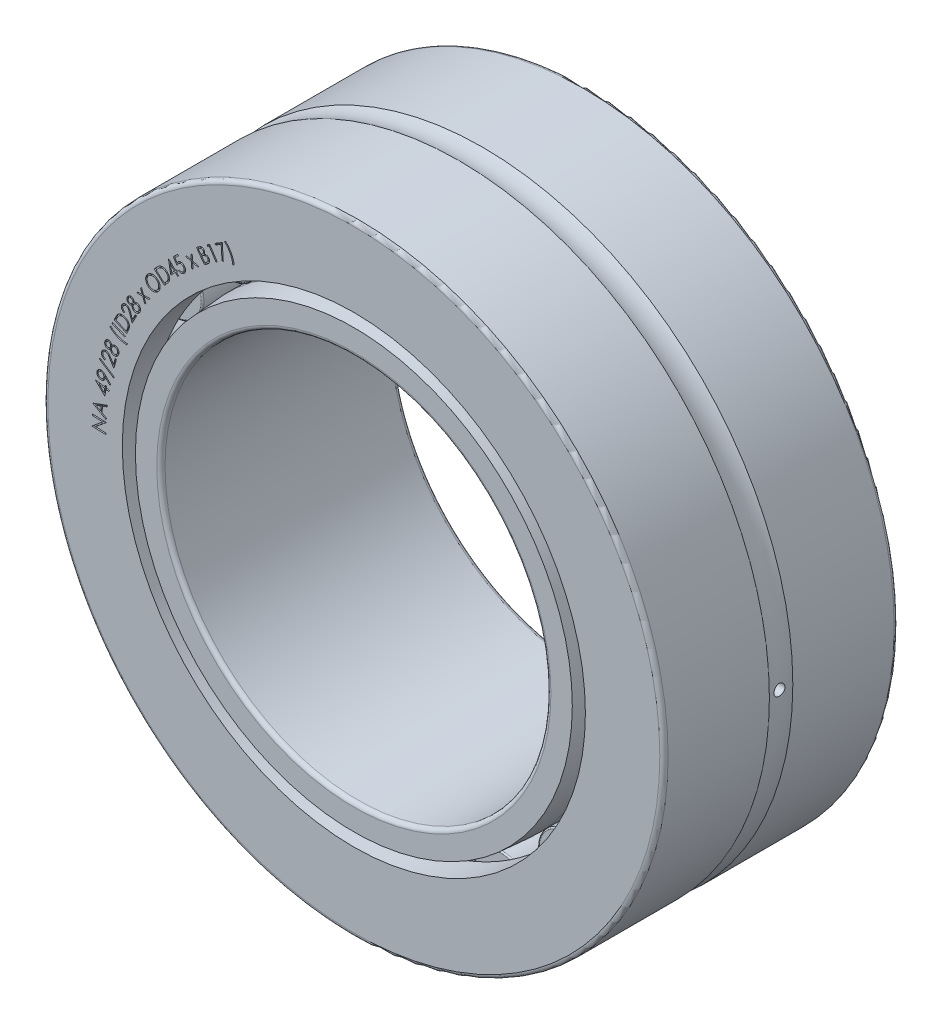
from build123d import *

# Parameters (mm, degrees)
FILLET1_R                 = 0.3
EXTRUDE3_REACH            = 53.936
EXTRUDE3_END_MAJOR_RADIUS = 24.851063589
EXTRUDE3_END_MINOR_RADIUS = 2.5
EXTRUDE3_START            = 19
SKETCH3_R                 = 0.4
EXTRUDE4_DEPTH            = 0.1
CIRPATTERN1_COUNT         = 19


with BuildPart() as part:
    # Sketch2 → Revolve1 (revolve)
    with BuildSketch(Plane(origin=(0, 0, 0), x_dir=(0, 0, -1), z_dir=(1, 0, 0)), mode=Mode.PRIVATE) as revolve1_sk:
        with BuildLine():
            Line((-8.2, 22.5), (-0.85, 22.5))
            ThreePointArc((-0.85, 22.5), (0, 22.351063589), (0.85, 22.5))
            Line((0.85, 22.5), (8.2, 22.5))
            ThreePointArc((8.2, 22.5), (8.412132034, 22.412132034), (8.5, 22.2))
            Line((8.5, 22.2), (8.5, 16.8))
            Line((8.5, 16.8), (6.4, 16.8))
            Line((6.4, 16.8), (6.4, 20))
            Line((6.4, 20), (-6.4, 20))
            Line((-6.4, 20), (-6.4, 16.8))
            Line((-6.4, 16.8), (-8.5, 16.8))
            Line((-8.5, 16.8), (-8.5, 22.2))
            ThreePointArc((-8.5, 22.2), (-8.412132034, 22.412132034), (-8.2, 22.5))
        make_face()
        Polygon((8.5, 15.85), (8.5, 14), (-8.5, 14), (-8.5, 15.85), (-6.4, 16), (6.4, 16), align=None)
    revolve(revolve1_sk.sketch.rotate(Axis((0, 0, 0), (0, 0, -1)), 90), axis=Axis((0, 0, 0), (0, 0, -1)))

    # Fillet1
    fillet1_edges = [part.edges().sort_by_distance(p)[0] for p in [
        (-14, 0, 8.5),
        (-14, 0, -8.5),
    ]]
    fillet(fillet1_edges, radius=FILLET1_R)

    # Extrude3: up to this torus (the profile starts outside it)
    extrude3_end = Plane(origin=(0, 0, 0), z_dir=(0, 0, 1)) * Torus(EXTRUDE3_END_MAJOR_RADIUS, EXTRUDE3_END_MINOR_RADIUS, mode=Mode.PRIVATE)
    # Sketch3 → Extrude3 (cut, up to the surface)
    with BuildSketch(Plane(origin=(0, 0, 0), x_dir=(0, 0, -1), z_dir=(1, 0, 0)).offset(EXTRUDE3_START), mode=Mode.PRIVATE) as extrude3_sk1:
        with Locations(Location((0, 0, 0), (0, 0, 180))):
            Circle(SKETCH3_R)
    extrude3_tool1 = extrude(extrude3_sk1.sketch, amount=EXTRUDE3_REACH, mode=Mode.PRIVATE) - extrude3_end
    add(extrude3_tool1.solids().sort_by_distance((19, 0, 0))[0], mode=Mode.SUBTRACT)

    # Sketch4 → Extrude4 (cut)
    # profile 1 of 22: a face of its own
    with BuildSketch(Plane(origin=(0, 0, 8.5), x_dir=(-1, 0, 0), z_dir=(0, 0, -1))):
        Polygon((17.996472889, 0.121791409), (18.991026571, 0.150759015), (18.990396098, 0.172392791), (18.209804836, 0.81132278), (18.971198292, 0.833428616), (18.96821559, 0.931574894), (17.973661908, 0.902607288), (17.974337954, 0.880173528), (18.745198989, 0.246507951), (17.99342814, 0.224548994), align=None)
    # profile 2 of 22: a face of its own
    with BuildSketch(Plane(origin=(0, 0, 8.5), x_dir=(-1, 0, 0), z_dir=(0, 0, -1))):
        Polygon((18.920341347, 1.637121483), (17.885993101, 2.015642624), (17.895066614, 1.908859696), (18.23573355, 1.780620634), (18.272497486, 1.351943753), (17.958573518, 1.16849269), (17.967967487, 1.057496164), (18.92232525, 1.612663572), align=None)
        Polygon((18.710303109, 1.606776447), (18.364605561, 1.404833197), (18.335592294, 1.744997426), align=None, mode=Mode.SUBTRACT)
    # profile 3 of 22: a face of its own
    with BuildSketch(Plane(origin=(0, 0, 8.5), x_dir=(-1, 0, 0), z_dir=(0, 0, -1))):
        Polygon((18.753998333, 3.16954266), (18.750876203, 3.189587815), (18.064257066, 3.08157855), (18.0454517, 3.200773164), (17.951061238, 3.185999324), (17.969866604, 3.06680471), (17.740675929, 3.030698765), (17.75611231, 2.932311615), (17.985302985, 2.96841756), (18.059497062, 2.4974127), align=None)
        Polygon((18.079693447, 2.9831914), (18.490433979, 3.047766796), (18.125412636, 2.693102951), align=None, mode=Mode.SUBTRACT)
    # profile 4 of 22: a face of its own
    with BuildSketch(Plane(origin=(0, 0, 8.5), x_dir=(-1, 0, 0), z_dir=(0, 0, -1))):
        with BuildLine():
            Line((17.638190882, 3.442224406), (17.706461692, 3.372514023))
            Line((17.706461692, 3.372514023), (18.05250626, 3.716724534))
            add(Edge.make_bspline(
                [(18.05250626, 3.716724534), (18.051604056, 3.707504632), (18.049844896, 3.689527229), (18.049806866, 3.663045273), (18.051220957, 3.637794911), (18.054089702, 3.621579693), (18.055493079, 3.613647281)],
                knots=[0, 0, 0, 0, 1.0732581, 2.092689843, 3.066952384, 4, 4, 4, 4], degree=3))
            add(Edge.make_bspline(
                [(18.055493079, 3.613647281), (18.057655466, 3.60422345), (18.061928593, 3.58560087), (18.071573345, 3.558914906), (18.083334621, 3.533694776), (18.097915348, 3.510378245), (18.114443583, 3.488418751), (18.133697049, 3.468384657), (18.155302537, 3.449947521), (18.178960545, 3.433153874), (18.204239351, 3.41864334), (18.230440504, 3.406616905), (18.257497228, 3.397722424), (18.285163785, 3.391277216), (18.313606935, 3.387684616), (18.342660851, 3.387201218), (18.372441676, 3.389109666), (18.392284952, 3.392595717), (18.402388397, 3.394370683)],
                knots=[0, 0, 0, 0, 1.014105398, 2.003989565, 2.972170537, 3.929790053, 4.885200999, 5.852417369, 6.839816883, 7.862893425, 8.893267069, 9.895212461, 10.883606586, 11.8776757, 12.873127662, 13.886554599, 14.923913584, 16, 16, 16, 16], degree=3))
            add(Edge.make_bspline(
                [(18.402388397, 3.394370683), (18.415991525, 3.397581773), (18.442741466, 3.403896237), (18.480459721, 3.419619962), (18.515265278, 3.439385769), (18.546739679, 3.463674125), (18.574858225, 3.491615086), (18.598334463, 3.523707571), (18.618073896, 3.558833005), (18.632614804, 3.597172786), (18.642945784, 3.637155311), (18.648054702, 3.67796839), (18.647861717, 3.7191685), (18.643307152, 3.746205423), (18.641009067, 3.759847371)],
                knots=[0, 0, 0, 0, 1.033200542, 2.031742362, 3.012719821, 3.988653018, 4.9662497, 5.936911072, 6.922770683, 7.940039407, 8.963259398, 9.973054839, 10.977269649, 12, 12, 12, 12], degree=3))
            add(Edge.make_bspline(
                [(18.641009067, 3.759847371), (18.637868619, 3.77304596), (18.631664027, 3.799122457), (18.616371579, 3.836173318), (18.596303616, 3.870489061), (18.572224401, 3.902207741), (18.544102854, 3.930238012), (18.512725031, 3.954371088), (18.477864338, 3.973437511), (18.440481066, 3.988037569), (18.401553127, 3.997757973), (18.361977519, 4.002733356), (18.322125669, 4.002209993), (18.295912107, 3.997975763), (18.282723279, 3.995845395)],
                knots=[0, 0, 0, 0, 1.021370084, 2.017924327, 3.007361784, 4.010767802, 5.010785463, 5.991480318, 6.98422743, 7.995015278, 9.008630861, 10.00056117, 10.994022434, 12, 12, 12, 12], degree=3))
            add(Edge.make_bspline(
                [(18.282723279, 3.995845395), (18.272594029, 3.99346522), (18.25197492, 3.988620134), (18.22155637, 3.977497782), (18.190931783, 3.963557823), (18.159886924, 3.945952806), (18.127542917, 3.924133817), (18.093561815, 3.896832841), (18.05688307, 3.864452995), (18.032454842, 3.840192343), (18.019580459, 3.827406276)],
                knots=[0, 0, 0, 0, 0.786812515, 1.601636007, 2.445886264, 3.330919397, 4.299130596, 5.395146614, 6.627166819, 8, 8, 8, 8], degree=3))
            Line((18.019580459, 3.827406276), (17.638190882, 3.442224406))
        make_face()
        with BuildLine():
            add(Edge.make_bspline(
                [(18.136284506, 3.653545975), (18.13505856, 3.660602558), (18.132646355, 3.674487287), (18.131313874, 3.695353298), (18.13204699, 3.715798387), (18.135079267, 3.735824533), (18.139751851, 3.755461832), (18.146716789, 3.774617861), (18.155554772, 3.793409711), (18.166514532, 3.811499248), (18.178827554, 3.82866142), (18.192793674, 3.844110379), (18.207660702, 3.85807465), (18.223887896, 3.870129371), (18.241164337, 3.880455925), (18.25957995, 3.889132908), (18.279254681, 3.895820942), (18.292873258, 3.899025438), (18.299779247, 3.90065044)],
                knots=[0, 0, 0, 0, 1.04197531, 2.050219563, 3.037299054, 4.014132017, 4.993910382, 5.970743345, 6.975702642, 8.011904436, 9.045413072, 10.045424702, 11.038610881, 12.009866746, 12.981706064, 13.96418063, 14.967634651, 16, 16, 16, 16], degree=3))
            add(Edge.make_bspline(
                [(18.299779247, 3.90065044), (18.306774743, 3.901858408), (18.320538896, 3.904235173), (18.341252049, 3.905380485), (18.361611108, 3.904971515), (18.381569706, 3.901921293), (18.40109802, 3.897067616), (18.420203367, 3.890243075), (18.438841975, 3.881179745), (18.456915906, 3.870300838), (18.474152011, 3.857969606), (18.48947515, 3.843874709), (18.503611423, 3.829083594), (18.515568437, 3.81277364), (18.525991193, 3.79540723), (18.534679894, 3.776919755), (18.541407371, 3.757120554), (18.544649294, 3.743443003), (18.546300782, 3.736475435)],
                knots=[0, 0, 0, 0, 1.033097565, 2.0326954, 3.01622156, 3.993574093, 4.966076212, 5.943428745, 6.942458734, 7.979211676, 9.013270027, 10.022612918, 11.007196272, 11.988411874, 12.960768106, 13.953482721, 14.957470471, 16, 16, 16, 16], degree=3))
            add(Edge.make_bspline(
                [(18.546300782, 3.736475435), (18.547508749, 3.729479939), (18.549885514, 3.715715788), (18.551030836, 3.695002624), (18.550621826, 3.674643604), (18.547571753, 3.654684866), (18.54271752, 3.635157073), (18.535895078, 3.616049757), (18.526823635, 3.597418759), (18.515976229, 3.579315281), (18.503546394, 3.562214694), (18.48991395, 3.546532972), (18.474818756, 3.532875712), (18.458898886, 3.52054735), (18.441548551, 3.510275708), (18.423126053, 3.501660569), (18.403562401, 3.494658989), (18.389933201, 3.491498754), (18.383019746, 3.489895714)],
                knots=[0, 0, 0, 0, 1.035357754, 2.037142488, 3.022820386, 4.002311151, 4.97694089, 5.956431655, 6.957647301, 7.996668428, 9.032989072, 10.039928294, 11.023338877, 11.99962408, 12.974107613, 13.95925533, 14.964825755, 16, 16, 16, 16], degree=3))
            add(Edge.make_bspline(
                [(18.383019746, 3.489895714), (18.37602441, 3.488693484), (18.362260571, 3.486328009), (18.341517124, 3.485098904), (18.321138458, 3.485817306), (18.301157285, 3.488808238), (18.281555537, 3.493617447), (18.26248173, 3.500768697), (18.243627094, 3.50957178), (18.225545165, 3.520548065), (18.208375079, 3.532851265), (18.192995863, 3.54679719), (18.178986492, 3.561536903), (18.167000043, 3.577738864), (18.156644921, 3.595001473), (18.148054722, 3.613443967), (18.141046382, 3.633002199), (18.137887075, 3.646632143), (18.136284506, 3.653545975)],
                knots=[0, 0, 0, 0, 1.034457818, 2.035371798, 3.024276664, 4.002916052, 4.97669864, 5.961952979, 6.968770714, 8.006888722, 9.042308593, 10.044169512, 11.030049241, 12.003101218, 12.976737727, 13.961029151, 14.965725531, 16, 16, 16, 16], degree=3))
        make_face(mode=Mode.SUBTRACT)
    # profile 5 of 22: a face of its own
    with BuildSketch(Plane(origin=(0, 0, 8.5), x_dir=(-1, 0, 0), z_dir=(0, 0, -1))):
        Polygon((18.421989296, 4.728812776), (17.396447208, 4.055828798), (17.420675372, 3.955216871), (18.446492151, 4.62766634), align=None)
    # profile 6 of 22: a face of its own
    with BuildSketch(Plane(origin=(0, 0, 8.5), x_dir=(-1, 0, 0), z_dir=(0, 0, -1))):
        with BuildLine():
            Line((18.036322033, 4.86443921), (18.062160313, 4.772634929))
            add(Edge.make_bspline(
                [(18.062160313, 4.772634929), (18.073538521, 4.776493793), (18.09594989, 4.784094499), (18.127768179, 4.798528297), (18.157292666, 4.815155906), (18.184382553, 4.834135681), (18.209098969, 4.855449637), (18.23144562, 4.879094619), (18.251332687, 4.905082028), (18.26883688, 4.932933226), (18.283705424, 4.96207284), (18.295283319, 4.99215604), (18.303647642, 5.022803631), (18.308769917, 5.053989569), (18.310603345, 5.085710822), (18.309144375, 5.117927364), (18.304705699, 5.150724729), (18.299116142, 5.172352445), (18.296282024, 5.183318516)],
                knots=[0, 0, 0, 0, 1.094490885, 2.155790977, 3.178835772, 4.178739715, 5.165219517, 6.148389985, 7.138467356, 8.142750825, 9.142654768, 10.115182541, 11.075273312, 12.033066126, 12.990298098, 13.965601866, 14.968483013, 16, 16, 16, 16], degree=3))
            add(Edge.make_bspline(
                [(18.296282024, 5.183318516), (18.293007655, 5.194028018), (18.286613948, 5.214939957), (18.273743136, 5.24454529), (18.258921266, 5.271873759), (18.241882923, 5.297027072), (18.222539082, 5.319778101), (18.200774168, 5.340015353), (18.176969148, 5.358074456), (18.151083307, 5.373408079), (18.1240364, 5.386203476), (18.096521195, 5.396459609), (18.06878354, 5.404081337), (18.040669565, 5.408538995), (18.01238486, 5.41020719), (17.983878583, 5.40903677), (17.955105159, 5.405166559), (17.93614178, 5.400352401), (17.9265161, 5.397908767)],
                knots=[0, 0, 0, 0, 1.124955002, 2.196646424, 3.238408797, 4.246321514, 5.24500639, 6.233420632, 7.228082455, 8.242833239, 9.251885131, 10.232060537, 11.191211904, 12.138381238, 13.088020749, 14.034642923, 15.002398395, 16, 16, 16, 16], degree=3))
            add(Edge.make_bspline(
                [(17.9265161, 5.397908767), (17.913304586, 5.393639138), (17.887061612, 5.385158068), (17.849968792, 5.366740525), (17.815574962, 5.343661401), (17.789027758, 5.320567316), (17.768386703, 5.299057726), (17.752103311, 5.27999465), (17.734571072, 5.258407465), (17.71635196, 5.233938766), (17.696975597, 5.206809638), (17.677031245, 5.176745496), (17.655700718, 5.144259657), (17.641657702, 5.121409278), (17.634386741, 5.109578187)],
                knots=[0, 0, 0, 0, 1.185391686, 2.354628118, 3.525423347, 4.716939784, 5.353656762, 6.071995119, 6.858961581, 7.730074794, 8.678752111, 9.707901892, 10.813235379, 12, 12, 12, 12], degree=3))
            Line((17.634386741, 5.109578187), (17.444603527, 4.798547681))
            Line((17.444603527, 4.798547681), (17.319848649, 5.240780955))
            Line((17.319848649, 5.240780955), (17.227256779, 5.214693908))
            Line((17.227256779, 5.214693908), (17.410887955, 4.564122232))
            Line((17.410887955, 4.564122232), (17.702919965, 5.04165347))
            add(Edge.make_bspline(
                [(17.702919965, 5.04165347), (17.710037987, 5.053262344), (17.723696485, 5.075538164), (17.743714121, 5.107435906), (17.762382336, 5.136352828), (17.780226447, 5.162104337), (17.796434632, 5.185071319), (17.811595972, 5.204976552), (17.825283194, 5.222019536), (17.841994517, 5.240394569), (17.863012313, 5.259903173), (17.89045357, 5.278675579), (17.919561988, 5.294102539), (17.940313812, 5.300802056), (17.950725649, 5.304163413)],
                knots=[0, 0, 0, 0, 1.324220742, 2.540995906, 3.662167083, 4.670913546, 5.587504429, 6.395438409, 7.103940389, 7.712249996, 8.810010195, 9.883024252, 10.937847289, 12, 12, 12, 12], degree=3))
            add(Edge.make_bspline(
                [(17.950725649, 5.304163413), (17.957425968, 5.305858461), (17.970593527, 5.309189592), (17.990670161, 5.311609666), (18.010500326, 5.312420674), (18.030256544, 5.310749342), (18.049719327, 5.306854412), (18.069115056, 5.301353587), (18.088151373, 5.293224149), (18.106983453, 5.283513081), (18.124824673, 5.271820374), (18.141410728, 5.258828277), (18.156333349, 5.244437573), (18.169830755, 5.228808286), (18.181480606, 5.211604961), (18.191617525, 5.193130483), (18.20035536, 5.17333861), (18.204579881, 5.159386578), (18.206731158, 5.152281701)],
                knots=[0, 0, 0, 0, 1.001254379, 1.967678841, 2.92606647, 3.875016469, 4.834430707, 5.801000674, 6.792658145, 7.830510942, 8.869988487, 9.880887783, 10.881345937, 11.87148957, 12.869977854, 13.887809112, 14.924396455, 16, 16, 16, 16], degree=3))
            add(Edge.make_bspline(
                [(18.206731158, 5.152281701), (18.208630968, 5.144700674), (18.212349406, 5.129862571), (18.215724209, 5.1074521), (18.216672444, 5.085441122), (18.215785529, 5.063783572), (18.212003609, 5.042686662), (18.206576948, 5.021936577), (18.198764754, 5.001642545), (18.188798618, 4.981936826), (18.176846583, 4.963006624), (18.16280525, 4.945126614), (18.146540437, 4.928681616), (18.128458437, 4.913304986), (18.108400795, 4.899079451), (18.086157752, 4.886281546), (18.062057342, 4.874460642), (18.045030559, 4.867830345), (18.036322033, 4.86443921)],
                knots=[0, 0, 0, 0, 1.007134221, 1.971231733, 2.915136482, 3.843887765, 4.758895679, 5.672201554, 6.605330197, 7.556078468, 8.514626727, 9.48683633, 10.480565689, 11.491005009, 12.543396126, 13.645480509, 14.795756455, 16, 16, 16, 16], degree=3))
        make_face()
    # profile 7 of 22: a face of its own
    with BuildSketch(Plane(origin=(0, 0, 8.5), x_dir=(-1, 0, 0), z_dir=(0, 0, -1))):
        with BuildLine():
            add(Edge.make_bspline(
                [(17.565584472, 5.944083703), (17.559002314, 5.950526367), (17.54622419, 5.963033688), (17.526674718, 5.980489507), (17.507058189, 5.995771348), (17.487737703, 6.009630114), (17.468383916, 6.021322615), (17.449229994, 6.031325954), (17.430273574, 6.039541778), (17.4052698, 6.047810875), (17.373708014, 6.054412025), (17.335199363, 6.056193008), (17.29624545, 6.052189868), (17.270918655, 6.045014542), (17.258050286, 6.041368809)],
                knots=[0, 0, 0, 0, 0.969090864, 1.88132263, 2.755730094, 3.584459137, 4.381643771, 5.132627056, 5.856840589, 6.552724299, 7.901130413, 9.234368454, 10.594801781, 12, 12, 12, 12], degree=3))
            add(Edge.make_bspline(
                [(17.258050286, 6.041368809), (17.249079939, 6.038189738), (17.231389884, 6.031920423), (17.206234777, 6.0197647), (17.182747449, 6.005627351), (17.160728219, 5.989628407), (17.140224941, 5.971695641), (17.121160616, 5.951897949), (17.103681879, 5.930029888), (17.093608573, 5.914152959), (17.088501651, 5.90610374)],
                knots=[0, 0, 0, 0, 1.030001312, 2.031223498, 3.019118417, 3.995326586, 4.97474316, 5.964990558, 6.968299496, 8, 8, 8, 8], degree=3))
            add(Edge.make_bspline(
                [(17.088501651, 5.90610374), (17.082772335, 5.895879952), (17.071386385, 5.875562076), (17.058981483, 5.842914981), (17.050642729, 5.809020816), (17.046019829, 5.77389216), (17.045803836, 5.737412513), (17.049177594, 5.699695403), (17.056737575, 5.660673498), (17.064643775, 5.634765151), (17.068703754, 5.621460739)],
                knots=[0, 0, 0, 0, 0.953075158, 1.894059418, 2.832276164, 3.789574067, 4.771315737, 5.795887214, 6.868147578, 8, 8, 8, 8], degree=3))
            add(Edge.make_bspline(
                [(17.068703754, 5.621460739), (17.073124785, 5.608781943), (17.081696329, 5.58420015), (17.098042315, 5.549775642), (17.115977484, 5.518464908), (17.136067102, 5.490476224), (17.158246751, 5.465839775), (17.182449464, 5.444483017), (17.208813401, 5.42649), (17.236933601, 5.412069035), (17.265937321, 5.401008523), (17.294724462, 5.391822591), (17.323387724, 5.385902043), (17.351773974, 5.382419741), (17.379945261, 5.381759006), (17.407824153, 5.383958627), (17.435492582, 5.388586688), (17.453377516, 5.394046879), (17.462400404, 5.396801526)],
                knots=[0, 0, 0, 0, 1.268728168, 2.459824634, 3.59694295, 4.676596336, 5.710615061, 6.724784385, 7.721111182, 8.720613325, 9.705027397, 10.653330858, 11.574514822, 12.467756298, 13.35425674, 14.233601953, 15.108858221, 16, 16, 16, 16], degree=3))
            add(Edge.make_bspline(
                [(17.462400404, 5.396801526), (17.475126173, 5.401570872), (17.500256505, 5.410989182), (17.534786091, 5.431316012), (17.565305258, 5.456549522), (17.587711721, 5.481069103), (17.603347019, 5.503270337), (17.614303801, 5.521617871), (17.624181046, 5.54163535), (17.63277057, 5.56336713), (17.640622916, 5.586609741), (17.647233716, 5.611552906), (17.653210234, 5.638036469), (17.65601554, 5.656359127), (17.657452433, 5.665744094)],
                knots=[0, 0, 0, 0, 1.386599848, 2.738201263, 4.070291771, 5.420290977, 6.11713152, 6.841867111, 7.601624042, 8.394945631, 9.227709629, 10.106723913, 11.030253469, 12, 12, 12, 12], degree=3))
            add(Edge.make_bspline(
                [(17.657452433, 5.665744094), (17.667219658, 5.656770923), (17.686167569, 5.639363438), (17.716867962, 5.617646078), (17.748543894, 5.601235318), (17.780842394, 5.590043156), (17.813268548, 5.583724726), (17.845386147, 5.582011449), (17.877130712, 5.585060953), (17.897425372, 5.590891829), (17.907632162, 5.59382435)],
                knots=[0, 0, 0, 0, 1.159025018, 2.248448447, 3.27732084, 4.268521419, 5.227305361, 6.156618964, 7.072908694, 8, 8, 8, 8], degree=3))
            add(Edge.make_bspline(
                [(17.907632162, 5.59382435), (17.917762574, 5.597640777), (17.938205821, 5.605342355), (17.966372957, 5.622935033), (17.992968704, 5.644445947), (18.016780425, 5.670567132), (18.038269219, 5.699709583), (18.055087349, 5.73220747), (18.067881721, 5.767005235), (18.07595489, 5.803922951), (18.079915412, 5.842003544), (18.078981685, 5.880510656), (18.073538193, 5.919014829), (18.066190205, 5.943991513), (18.062480075, 5.956602685)],
                knots=[0, 0, 0, 0, 0.890399138, 1.79683216, 2.722561421, 3.702747162, 4.70191153, 5.698890471, 6.707950785, 7.749730673, 8.805663473, 9.856289648, 10.917602449, 12, 12, 12, 12], degree=3))
            add(Edge.make_bspline(
                [(18.062480075, 5.956602685), (18.058082689, 5.96861974), (18.049395857, 5.992358874), (18.03096371, 6.025369346), (18.009120782, 6.055815248), (17.983497434, 6.082991218), (17.955106808, 6.106549576), (17.92471474, 6.126331759), (17.891949175, 6.141124609), (17.857820377, 6.151451549), (17.823090924, 6.157512578), (17.788716267, 6.158627446), (17.754926042, 6.155184926), (17.73335104, 6.149063956), (17.722502141, 6.145986052)],
                knots=[0, 0, 0, 0, 1.065969249, 2.105772862, 3.141840194, 4.185069367, 5.211766728, 6.213116047, 7.200440589, 8.199696411, 9.180589829, 10.132249918, 11.060809619, 12, 12, 12, 12], degree=3))
            add(Edge.make_bspline(
                [(17.722502141, 6.145986052), (17.712144349, 6.142144416), (17.691821186, 6.13460669), (17.664020227, 6.118158338), (17.639338862, 6.098261459), (17.61797814, 6.074561356), (17.599833687, 6.047219192), (17.585200718, 6.016101924), (17.573278258, 5.981473527), (17.568211412, 5.956849958), (17.565584472, 5.944083703)],
                knots=[0, 0, 0, 0, 0.9809554, 1.924745915, 2.858107693, 3.791072582, 4.751093097, 5.765980779, 6.841757729, 8, 8, 8, 8], degree=3))
        make_face()
        with BuildLine():
            add(Edge.make_bspline(
                [(17.971845486, 5.921504309), (17.973819172, 5.915098688), (17.977685323, 5.902551042), (17.981302313, 5.883524989), (17.983727447, 5.864885281), (17.984021471, 5.84653631), (17.982870171, 5.828541575), (17.979721044, 5.81097555), (17.975057966, 5.793712221), (17.968435798, 5.777065649), (17.960822446, 5.761226481), (17.951763081, 5.746757301), (17.941835173, 5.733601321), (17.930708366, 5.721866033), (17.918509536, 5.711572056), (17.905146805, 5.702760797), (17.890771008, 5.695251845), (17.880500921, 5.691602966), (17.875335747, 5.689767821)],
                knots=[0, 0, 0, 0, 1.150499767, 2.253655501, 3.322097028, 4.375471426, 5.400615696, 6.414727918, 7.435821616, 8.46685242, 9.487752833, 10.450487165, 11.394244402, 12.314498404, 13.22244678, 14.129742867, 15.059384557, 16, 16, 16, 16], degree=3))
            add(Edge.make_bspline(
                [(17.875335747, 5.689767821), (17.870041191, 5.688188011), (17.85953058, 5.685051816), (17.843303117, 5.682753766), (17.826979585, 5.681869079), (17.810447599, 5.683333908), (17.793658506, 5.686457495), (17.776588732, 5.691234967), (17.759494421, 5.698303576), (17.742389573, 5.706751863), (17.72589922, 5.716718664), (17.710595545, 5.72790811), (17.69668733, 5.740226858), (17.68423725, 5.75372041), (17.673158688, 5.768317502), (17.663677205, 5.784044244), (17.655166172, 5.800689538), (17.650996039, 5.812544333), (17.6488754, 5.818572858)],
                knots=[0, 0, 0, 0, 0.922086652, 1.830501928, 2.731071058, 3.648487516, 4.595815939, 5.582289509, 6.60422243, 7.682127573, 8.767916071, 9.819629584, 10.845999766, 11.867506183, 12.882961439, 13.90227159, 14.933241095, 16, 16, 16, 16], degree=3))
            add(Edge.make_bspline(
                [(17.6488754, 5.818572858), (17.646662834, 5.82642195), (17.642250225, 5.842075714), (17.63918683, 5.866297491), (17.63932708, 5.890779632), (17.642195952, 5.915264166), (17.648331346, 5.93916257), (17.657562314, 5.961702362), (17.669269816, 5.982930543), (17.684223294, 6.001901618), (17.700926145, 6.018691853), (17.718778662, 6.032996157), (17.737644311, 6.04446994), (17.751162441, 6.049532317), (17.757817426, 6.052024529)],
                knots=[0, 0, 0, 0, 1.029832345, 2.053836581, 3.073517751, 4.118460147, 5.162549877, 6.181706852, 7.190463994, 8.216588217, 9.22414391, 10.178570378, 11.103308836, 12, 12, 12, 12], degree=3))
            add(Edge.make_bspline(
                [(17.757817426, 6.052024529), (17.762621003, 6.053461457), (17.772177973, 6.0563203), (17.786973578, 6.058667238), (17.801928171, 6.059345861), (17.817053361, 6.058947644), (17.832334988, 6.05649898), (17.847847264, 6.052800313), (17.863481765, 6.047330817), (17.879242202, 6.040662361), (17.894492865, 6.032077996), (17.908968196, 6.021754397), (17.922184757, 6.009421039), (17.934597179, 5.995559942), (17.945456616, 5.979469005), (17.955581584, 5.961851104), (17.964412372, 5.942325659), (17.969322426, 5.928571808), (17.971845486, 5.921504309)],
                knots=[0, 0, 0, 0, 0.858974057, 1.708974256, 2.559976224, 3.423591978, 4.29791755, 5.208232486, 6.154622466, 7.134491961, 8.138869408, 9.149037698, 10.175169876, 11.232445011, 12.332077621, 13.496551284, 14.7135879, 16, 16, 16, 16], degree=3))
        make_face(mode=Mode.SUBTRACT)
        with BuildLine():
            add(Edge.make_bspline(
                [(17.562906035, 5.7916549), (17.565387557, 5.783613799), (17.570275054, 5.767776404), (17.574726575, 5.743632414), (17.577091459, 5.719853927), (17.577277626, 5.696381206), (17.574727277, 5.673278239), (17.570027307, 5.650530846), (17.563067353, 5.628053431), (17.553767114, 5.606290926), (17.542852278, 5.58547402), (17.5303698, 5.566334432), (17.516742407, 5.548848718), (17.501601415, 5.533385917), (17.485053861, 5.519938504), (17.467200728, 5.508319017), (17.448160693, 5.49827171), (17.434544968, 5.493408469), (17.427687479, 5.490959123)],
                knots=[0, 0, 0, 0, 1.102714468, 2.171857324, 3.212509769, 4.233526903, 5.243673008, 6.254426126, 7.275443259, 8.323620139, 9.353608819, 10.353839326, 11.316096183, 12.256105045, 13.185285274, 14.106177225, 15.046186087, 16, 16, 16, 16], degree=3))
            add(Edge.make_bspline(
                [(17.427687479, 5.490959123), (17.418955816, 5.488420591), (17.401586805, 5.483370947), (17.374393284, 5.480715652), (17.346885525, 5.481659173), (17.319293992, 5.486467428), (17.29230293, 5.49460027), (17.266851258, 5.506961789), (17.243071714, 5.522800349), (17.221187215, 5.542347492), (17.201597609, 5.56537758), (17.184102923, 5.591339425), (17.169387394, 5.620555564), (17.161746233, 5.641470328), (17.157825187, 5.652202699)],
                knots=[0, 0, 0, 0, 0.929880202, 1.849716376, 2.784540582, 3.742506523, 4.711208352, 5.662900838, 6.630176487, 7.629716169, 8.658601965, 9.720017403, 10.830031398, 12, 12, 12, 12], degree=3))
            add(Edge.make_bspline(
                [(17.157825187, 5.652202699), (17.155159724, 5.660695813), (17.149969934, 5.677232338), (17.145260124, 5.702319895), (17.142278724, 5.726554056), (17.141954483, 5.750225236), (17.143848696, 5.773130728), (17.148477445, 5.795372626), (17.155000069, 5.817009313), (17.164264725, 5.837626428), (17.175092529, 5.857048317), (17.187449584, 5.874904271), (17.200889185, 5.891193738), (17.21572958, 5.905691272), (17.231928149, 5.918336609), (17.249255479, 5.929453931), (17.267925917, 5.938754268), (17.281066806, 5.943544544), (17.287706212, 5.94596482)],
                knots=[0, 0, 0, 0, 1.189034051, 2.315109861, 3.406870647, 4.44980185, 5.474347007, 6.472974043, 7.481763867, 8.489368042, 9.488234451, 10.450902216, 11.388406611, 12.307496898, 13.218444042, 14.131139143, 15.055762003, 16, 16, 16, 16], degree=3))
            add(Edge.make_bspline(
                [(17.287706212, 5.94596482), (17.294294223, 5.947927763), (17.307354395, 5.951819131), (17.32745165, 5.955160157), (17.347688544, 5.955908968), (17.367957855, 5.954785516), (17.38836737, 5.951362654), (17.408934658, 5.945913426), (17.42946771, 5.937773536), (17.449955696, 5.927905505), (17.469695565, 5.916185109), (17.488115174, 5.902896264), (17.504648787, 5.887864091), (17.519746353, 5.871601111), (17.533171714, 5.853731245), (17.544893342, 5.834456867), (17.554996419, 5.81371528), (17.560236015, 5.799101742), (17.562906035, 5.7916549)],
                knots=[0, 0, 0, 0, 0.944062993, 1.871524693, 2.790275499, 3.721949148, 4.656375162, 5.629425421, 6.640040893, 7.686673331, 8.751806267, 9.790768007, 10.802133039, 11.817486382, 12.836068728, 13.867874103, 14.913500454, 16, 16, 16, 16], degree=3))
        make_face(mode=Mode.SUBTRACT)
    # profile 8 of 22: a face of its own
    with BuildSketch(Plane(origin=(0, 0, 8.5), x_dir=(-1, 0, 0), z_dir=(0, 0, -1))):
        with BuildLine():
            Line((17.686197867, 7.028498882), (17.646399356, 7.129965636))
            add(Edge.make_bspline(
                [(17.646399356, 7.129965636), (17.637735242, 7.120661491), (17.620193777, 7.101824212), (17.592276335, 7.074531818), (17.562641112, 7.047646704), (17.531759206, 7.020611648), (17.499026834, 6.994001197), (17.464607981, 6.967756455), (17.428664756, 6.941666661), (17.378630218, 6.907069925), (17.313574498, 6.86571595), (17.232084664, 6.82040363), (17.147542093, 6.778861977), (17.089132476, 6.75490659), (17.059731281, 6.742848353)],
                knots=[0, 0, 0, 0, 0.645954272, 1.307806514, 1.983047387, 2.679017541, 3.393128946, 4.126095237, 4.878155559, 5.649747672, 7.216934876, 8.79284314, 10.385638383, 12, 12, 12, 12], degree=3))
            add(Edge.make_bspline(
                [(17.059731281, 6.742848353), (17.032346302, 6.732407252), (16.977995404, 6.711684825), (16.895417647, 6.685373091), (16.812949269, 6.663009373), (16.731199618, 6.644727535), (16.651335013, 6.630722586), (16.574482011, 6.62096597), (16.501129226, 6.615606583), (16.453411624, 6.615618765), (16.430197008, 6.615624692)],
                knots=[0, 0, 0, 0, 1.088427606, 2.160199542, 3.217505076, 4.261367009, 5.270553571, 6.228069258, 7.137955576, 8, 8, 8, 8], degree=3))
            Line((16.430197008, 6.615624692), (16.46819311, 6.519323888))
            add(Edge.make_bspline(
                [(16.46819311, 6.519323888), (16.490463752, 6.519367747), (16.536433453, 6.519458278), (16.60742696, 6.524719641), (16.682305292, 6.534488905), (16.760625115, 6.548027262), (16.840991098, 6.565938431), (16.922248376, 6.587881548), (17.003692369, 6.614095048), (17.057471139, 6.634459242), (17.08462409, 6.644741142)],
                knots=[0, 0, 0, 0, 0.844462767, 1.74308859, 2.69754615, 3.707648071, 4.756590134, 5.819224983, 6.898924678, 8, 8, 8, 8], degree=3))
            add(Edge.make_bspline(
                [(17.08462409, 6.644741142), (17.113621343, 6.65656316), (17.171332597, 6.680091714), (17.255196856, 6.720460943), (17.336373784, 6.764260329), (17.414508944, 6.811423237), (17.489217603, 6.861444202), (17.559456164, 6.914371928), (17.62537101, 6.969613567), (17.666042304, 7.008986668), (17.686197867, 7.028498882)],
                knots=[0, 0, 0, 0, 1.045896179, 2.081575795, 3.107385835, 4.126294506, 5.12928575, 6.109465071, 7.063103456, 8, 8, 8, 8], degree=3))
        make_face()
    # profile 9 of 22: a face of its own
    with BuildSketch(Plane(origin=(0, 0, 8.5), x_dir=(-1, 0, 0), z_dir=(0, 0, -1))):
        Polygon((17.532144141, 7.318582106), (17.493507645, 7.410539882), (16.572662487, 7.023453465), (16.611298983, 6.931495689), align=None)
    # profile 10 of 22: a face of its own
    with BuildSketch(Plane(origin=(0, 0, 8.5), x_dir=(-1, 0, 0), z_dir=(0, 0, -1))):
        with BuildLine():
            Line((16.482429722, 7.226048), (17.384675083, 7.645545814))
            Line((17.384675083, 7.645545814), (17.297738231, 7.832646219))
            add(Edge.make_bspline(
                [(17.297738231, 7.832646219), (17.290122547, 7.848913953), (17.275413084, 7.880334591), (17.252406031, 7.924876648), (17.230691436, 7.965820291), (17.209088207, 8.002590406), (17.188473946, 8.035645285), (17.168150547, 8.064649074), (17.148639203, 8.089817394), (17.134967615, 8.10451892), (17.128540443, 8.111430277)],
                knots=[0, 0, 0, 0, 1.316512192, 2.542803607, 3.674399801, 4.713175152, 5.66827546, 6.529016435, 7.30847359, 8, 8, 8, 8], degree=3))
            add(Edge.make_bspline(
                [(17.128540443, 8.111430277), (17.119550457, 8.120230251), (17.101727885, 8.137676125), (17.072977482, 8.161064988), (17.042972258, 8.181730702), (17.011563525, 8.199418935), (16.979039579, 8.214678855), (16.945098583, 8.226902992), (16.909918123, 8.23633304), (16.873587388, 8.242820088), (16.836541704, 8.246695324), (16.799054739, 8.247466247), (16.761315564, 8.245373578), (16.72321937, 8.240514213), (16.684948398, 8.232258697), (16.646297234, 8.22143873), (16.607336138, 8.207694875), (16.58180694, 8.19629455), (16.568851103, 8.190508988)],
                knots=[0, 0, 0, 0, 0.996863991, 1.976274477, 2.933841362, 3.881717408, 4.830671821, 5.778592209, 6.737635681, 7.714611351, 8.701247638, 9.687500454, 10.683591164, 11.695201371, 12.728651647, 13.784273231, 14.875538646, 16, 16, 16, 16], degree=3))
            add(Edge.make_bspline(
                [(16.568851103, 8.190508988), (16.557775617, 8.185167419), (16.535947161, 8.174639827), (16.504888019, 8.156638497), (16.475589634, 8.1375391), (16.448028691, 8.117150631), (16.422486507, 8.095254601), (16.398866136, 8.0719156), (16.377057679, 8.047324063), (16.357098925, 8.02151741), (16.339277084, 7.994868383), (16.323745251, 7.967641773), (16.310240355, 7.940225706), (16.298921231, 7.912474242), (16.289642935, 7.884471254), (16.282891888, 7.856035159), (16.277931454, 7.827356417), (16.275588649, 7.798089285), (16.275545092, 7.767808996), (16.278207971, 7.736145727), (16.283275287, 7.702834116), (16.291426766, 7.668003091), (16.301877093, 7.631491601), (16.315044772, 7.593341581), (16.330775792, 7.553607132), (16.342853079, 7.526874027), (16.349062753, 7.513128899)],
                knots=[0, 0, 0, 0, 1.090523404, 2.149291026, 3.181951158, 4.192073564, 5.188344125, 6.16389979, 7.135689269, 8.102156017, 9.055940411, 9.977331629, 10.881033935, 11.765246739, 12.634268055, 13.49525698, 14.355756682, 15.213785645, 16.09664808, 17.039125633, 18.029939362, 19.083190802, 20.210267553, 21.397879116, 22.662090099, 24, 24, 24, 24], degree=3))
            Line((16.349062753, 7.513128899), (16.482429722, 7.226048))
        make_face()
        with BuildLine():
            Line((16.527598009, 7.352272773), (16.479091361, 7.456626246))
            add(Edge.make_bspline(
                [(16.479091361, 7.456626246), (16.47217302, 7.471658223), (16.458899739, 7.500498037), (16.440625755, 7.542321105), (16.424984062, 7.580986342), (16.411593847, 7.616390197), (16.400274982, 7.648447334), (16.391912969, 7.677426882), (16.385487746, 7.703048427), (16.382905055, 7.719221558), (16.381708707, 7.726713241)],
                knots=[0, 0, 0, 0, 1.379099995, 2.645891868, 3.80343582, 4.854759208, 5.800572302, 6.63558959, 7.367980726, 8, 8, 8, 8], degree=3))
            add(Edge.make_bspline(
                [(16.381708707, 7.726713241), (16.380724559, 7.736394568), (16.378781877, 7.755505272), (16.378720737, 7.784037168), (16.38093636, 7.811926734), (16.385269852, 7.839233264), (16.391976927, 7.865997486), (16.401260647, 7.892029022), (16.41245152, 7.917659916), (16.426162687, 7.942425947), (16.441898433, 7.96646794), (16.459827045, 7.989223172), (16.479850599, 8.010713942), (16.501840697, 8.030907364), (16.526081442, 8.049708515), (16.5519887, 8.067647921), (16.580323045, 8.083792294), (16.600104736, 8.093520419), (16.610199982, 8.098485001)],
                knots=[0, 0, 0, 0, 0.995141119, 1.964384315, 2.914219769, 3.85504482, 4.789997743, 5.732730786, 6.679613376, 7.648302643, 8.625339526, 9.616533148, 10.608291661, 11.627689712, 12.667419479, 13.744759711, 14.849076929, 16, 16, 16, 16], degree=3))
            add(Edge.make_bspline(
                [(16.610199982, 8.098485001), (16.620973788, 8.103295723), (16.642134676, 8.112744485), (16.674479161, 8.124169902), (16.706522542, 8.132965621), (16.738310281, 8.139488616), (16.76979397, 8.143246557), (16.801048262, 8.144667016), (16.832019745, 8.14347004), (16.862600007, 8.139596902), (16.892546007, 8.133564029), (16.921557473, 8.124908326), (16.949386968, 8.113638247), (16.976278437, 8.100391324), (17.001689939, 8.084160665), (17.026386232, 8.066205882), (17.04968882, 8.045376561), (17.06410056, 8.030062421), (17.071415173, 8.0222898)],
                knots=[0, 0, 0, 0, 1.124041567, 2.207735678, 3.264952718, 4.288525784, 5.297035522, 6.283237389, 7.267137443, 8.246665686, 9.217641471, 10.175159261, 11.12693009, 12.076081039, 13.027256106, 13.996541586, 14.983153925, 16, 16, 16, 16], degree=3))
            add(Edge.make_bspline(
                [(17.071415173, 8.0222898), (17.077042327, 8.015672087), (17.089081643, 8.001513464), (17.106431545, 7.97743402), (17.124614209, 7.949637664), (17.143845432, 7.918252127), (17.163501281, 7.88290543), (17.183922032, 7.843747408), (17.205601137, 7.801002327), (17.21966338, 7.770906661), (17.226962665, 7.755284912)],
                knots=[0, 0, 0, 0, 0.672508427, 1.438834253, 2.296217071, 3.244669164, 4.288704381, 5.427591447, 6.664740547, 8, 8, 8, 8], degree=3))
            Line((17.226962665, 7.755284912), (17.256684828, 7.691417391))
            Line((17.256684828, 7.691417391), (16.527598009, 7.352272773))
        make_face(mode=Mode.SUBTRACT)
    # profile 11 of 22: a face of its own
    with BuildSketch(Plane(origin=(0, 0, 8.5), x_dir=(-1, 0, 0), z_dir=(0, 0, -1))):
        with BuildLine():
            Line((16.633372633, 8.509138868), (16.67798498, 8.424372146))
            add(Edge.make_bspline(
                [(16.67798498, 8.424372146), (16.688418843, 8.430467353), (16.708925022, 8.44244656), (16.737008809, 8.463473474), (16.762629154, 8.485906413), (16.785158265, 8.510358247), (16.805027772, 8.536418572), (16.822179208, 8.564147252), (16.836279452, 8.593825384), (16.847715526, 8.624810942), (16.855943425, 8.656693128), (16.861246143, 8.688652325), (16.86283629, 8.720484099), (16.861868423, 8.752160562), (16.856570159, 8.783610138), (16.848642163, 8.814978732), (16.837383459, 8.846213135), (16.827452038, 8.86628255), (16.822405293, 8.876481013)],
                knots=[0, 0, 0, 0, 1.0961467, 2.15431049, 3.179009889, 4.183702719, 5.166880558, 6.150058396, 7.137673468, 8.144740642, 9.143730414, 10.12258229, 11.080029275, 12.032917832, 12.993372621, 13.968463574, 14.967655617, 16, 16, 16, 16], degree=3))
            add(Edge.make_bspline(
                [(16.822405293, 8.876481013), (16.816931049, 8.886294984), (16.806214976, 8.905506265), (16.787459728, 8.931940728), (16.767154102, 8.955772825), (16.745059129, 8.976736972), (16.72134729, 8.995130884), (16.69563994, 9.010330057), (16.668497083, 9.023329412), (16.639754277, 9.032874613), (16.610550029, 9.039860172), (16.581415692, 9.044385355), (16.552556085, 9.045818915), (16.524058879, 9.044362161), (16.49584954, 9.040359228), (16.468063064, 9.033241126), (16.440680283, 9.023249034), (16.423108629, 9.014591001), (16.414217636, 9.010210166)],
                knots=[0, 0, 0, 0, 1.12383716, 2.199960714, 3.237276024, 4.252314562, 5.242684676, 6.233437917, 7.235282651, 8.248582223, 9.257465947, 10.237685587, 11.194603114, 12.143461454, 13.08918548, 14.040862916, 15.008706128, 16, 16, 16, 16], degree=3))
            add(Edge.make_bspline(
                [(16.414217636, 9.010210166), (16.402075945, 9.003236429), (16.378035747, 8.989428631), (16.345440693, 8.963554613), (16.316529805, 8.933748613), (16.295166213, 8.905629788), (16.279483172, 8.88022414), (16.267325902, 8.858170114), (16.254948849, 8.833154241), (16.241863565, 8.805456869), (16.228999498, 8.774595959), (16.215410062, 8.741066721), (16.201311122, 8.704676944), (16.192350364, 8.67929301), (16.187708228, 8.666142821)],
                knots=[0, 0, 0, 0, 1.190898537, 2.357944888, 3.529096944, 4.718691963, 5.356084042, 6.070018553, 6.861996561, 7.73216909, 8.677680306, 9.708123335, 10.812689579, 12, 12, 12, 12], degree=3))
            Line((16.187708228, 8.666142821), (16.065979696, 8.32113974))
            Line((16.065979696, 8.32113974), (15.851158009, 8.729362522))
            Line((15.851158009, 8.729362522), (15.765720979, 8.684481185))
            Line((15.765720979, 8.684481185), (16.081688494, 8.083731233))
            Line((16.081688494, 8.083731233), (16.268920246, 8.613843278))
            add(Edge.make_bspline(
                [(16.268920246, 8.613843278), (16.273463153, 8.626667536), (16.282213298, 8.651368491), (16.295357633, 8.686742437), (16.307700182, 8.719048745), (16.319553285, 8.748085952), (16.330923055, 8.773912697), (16.341625767, 8.796620696), (16.351558123, 8.816279012), (16.364041982, 8.837943594), (16.380964202, 8.861246485), (16.403537282, 8.885884042), (16.429102148, 8.906953515), (16.448111207, 8.917875424), (16.457635539, 8.923347757)],
                knots=[0, 0, 0, 0, 1.317674258, 2.537987987, 3.654848528, 4.667083452, 5.575258274, 6.387554529, 7.098269616, 7.707869279, 8.807596842, 9.879513799, 10.937547803, 12, 12, 12, 12], degree=3))
            add(Edge.make_bspline(
                [(16.457635539, 8.923347757), (16.463794316, 8.92644059), (16.475975888, 8.932557969), (16.495233415, 8.938931493), (16.514603327, 8.943900696), (16.534307003, 8.946359903), (16.554215812, 8.946672738), (16.57440192, 8.945048702), (16.594901577, 8.941429681), (16.615323492, 8.93554478), (16.635236487, 8.927980645), (16.654196976, 8.918627436), (16.672006174, 8.907704587), (16.688444504, 8.894974078), (16.703435016, 8.88044445), (16.717221856, 8.864400393), (16.729905779, 8.846741448), (16.737012908, 8.833919567), (16.740635503, 8.827384089)],
                knots=[0, 0, 0, 0, 0.993964357, 1.965982939, 2.922135685, 3.878288431, 4.825501093, 5.79310923, 6.798653061, 7.826286327, 8.857712944, 9.870948792, 10.874965671, 11.869865083, 12.867005053, 13.884453578, 14.921678686, 16, 16, 16, 16], degree=3))
            add(Edge.make_bspline(
                [(16.740635503, 8.827384089), (16.744096275, 8.820377543), (16.750889866, 8.806623497), (16.758757038, 8.785314951), (16.764380334, 8.763919814), (16.767644808, 8.742414417), (16.768744541, 8.720907023), (16.767790406, 8.699367759), (16.76406017, 8.677896172), (16.758727343, 8.656396308), (16.750753415, 8.635360728), (16.740639383, 8.614883021), (16.728296438, 8.595197415), (16.713793942, 8.576190204), (16.69700822, 8.558084849), (16.677720463, 8.541059527), (16.656702419, 8.524246879), (16.641277074, 8.514257663), (16.633372633, 8.509138868)],
                knots=[0, 0, 0, 0, 1.002843869, 1.968610576, 2.910643607, 3.838683715, 4.756089077, 5.67217146, 6.600330367, 7.54963099, 8.512386636, 9.48236828, 10.477818587, 11.490799448, 12.548090564, 13.641876592, 14.791621984, 16, 16, 16, 16], degree=3))
        make_face()
    # profile 12 of 22: a face of its own
    with BuildSketch(Plane(origin=(0, 0, 8.5), x_dir=(-1, 0, 0), z_dir=(0, 0, -1))):
        with BuildLine():
            add(Edge.make_bspline(
                [(15.946016894, 9.457733241), (15.938356507, 9.462628428), (15.923380807, 9.472198289), (15.900777945, 9.485073788), (15.878552876, 9.496034491), (15.856921869, 9.505343607), (15.835853202, 9.513038234), (15.815216576, 9.518648839), (15.795091264, 9.522791059), (15.769071353, 9.525625588), (15.737024737, 9.52544874), (15.699273442, 9.519324713), (15.662349388, 9.507301875), (15.639339369, 9.495042574), (15.6276518, 9.488815659)],
                knots=[0, 0, 0, 0, 0.963863041, 1.884307387, 2.756598517, 3.590096323, 4.380466655, 5.132617528, 5.855818141, 6.556807671, 7.904864459, 9.239522846, 10.597860041, 12, 12, 12, 12], degree=3))
            add(Edge.make_bspline(
                [(15.6276518, 9.488815659), (15.619616153, 9.483857223), (15.603787611, 9.474090142), (15.581730924, 9.457358554), (15.561824779, 9.438839218), (15.543687308, 9.418768958), (15.527505159, 9.397103891), (15.51321639, 9.373851808), (15.500629443, 9.349123702), (15.49414704, 9.331600917), (15.490868234, 9.322737875)],
                knots=[0, 0, 0, 0, 1.030152604, 2.029184736, 3.015644542, 3.993451973, 4.97783675, 5.962356401, 6.969357724, 8, 8, 8, 8], degree=3))
            add(Edge.make_bspline(
                [(15.490868234, 9.322737875), (15.487402686, 9.311641677), (15.480513149, 9.289582352), (15.475181372, 9.255342885), (15.473948026, 9.220701161), (15.476714621, 9.185630007), (15.483704825, 9.150076761), (15.495395435, 9.114345735), (15.510365567, 9.077884608), (15.523427638, 9.054377451), (15.530126935, 9.042321062)],
                knots=[0, 0, 0, 0, 0.952458922, 1.893495559, 2.83172284, 3.79025659, 4.77283622, 5.795990838, 6.869604274, 8, 8, 8, 8], degree=3))
            add(Edge.make_bspline(
                [(15.530126935, 9.042321062), (15.537069134, 9.03094225), (15.550539886, 9.008862624), (15.573245184, 8.978637215), (15.597148533, 8.952044276), (15.622373046, 8.929061805), (15.648951776, 8.909719123), (15.676970997, 8.894147024), (15.706131728, 8.881764432), (15.736540889, 8.873834565), (15.766910254, 8.868717565), (15.796779904, 8.866165846), (15.825844229, 8.865958607), (15.854150191, 8.868662958), (15.881650227, 8.873848513), (15.908264999, 8.881691789), (15.934182716, 8.891932883), (15.950474042, 8.900922558), (15.95868696, 8.905454508)],
                knots=[0, 0, 0, 0, 1.26899959, 2.462386663, 3.594692024, 4.670146275, 5.706800484, 6.718054355, 7.717540055, 8.715567774, 9.703411271, 10.648224164, 11.568046989, 12.467863543, 13.352241282, 14.229293573, 15.107336871, 16, 16, 16, 16], degree=3))
            add(Edge.make_bspline(
                [(15.95868696, 8.905454508), (15.970048096, 8.912721239), (15.992435189, 8.927040317), (16.021790812, 8.953830232), (16.046307478, 8.984514484), (16.062928065, 9.01301954), (16.073605142, 9.037718016), (16.080293773, 9.057852751), (16.085773009, 9.079294521), (16.089983149, 9.102120782), (16.092392753, 9.126280317), (16.094012143, 9.151762732), (16.094001728, 9.178682578), (16.093054007, 9.197078376), (16.092567816, 9.206515625)],
                knots=[0, 0, 0, 0, 1.387395993, 2.733860897, 4.071653396, 5.419926802, 6.118772371, 6.840499822, 7.603061945, 8.397084606, 9.228938828, 10.102600725, 11.02661298, 12, 12, 12, 12], degree=3))
            add(Edge.make_bspline(
                [(16.092567816, 9.206515625), (16.103952419, 9.19976592), (16.125934782, 9.186733011), (16.160429989, 9.172387878), (16.194424781, 9.162827592), (16.228067444, 9.158624734), (16.260829684, 9.159278485), (16.292379327, 9.164254317), (16.322669381, 9.173567623), (16.341194687, 9.183355992), (16.350512952, 9.188279561)],
                knots=[0, 0, 0, 0, 1.164714357, 2.248929951, 3.280417995, 4.266843016, 5.224216691, 6.157579926, 7.073259085, 8, 8, 8, 8], degree=3))
            add(Edge.make_bspline(
                [(16.350512952, 9.188279561), (16.359565247, 9.19412115), (16.377740098, 9.205849668), (16.40150351, 9.228733768), (16.422828747, 9.255094427), (16.440622679, 9.285355948), (16.455247457, 9.31803973), (16.465222263, 9.352937143), (16.470311007, 9.389375064), (16.470534075, 9.426964047), (16.466375759, 9.464730401), (16.457779133, 9.501969562), (16.444455381, 9.538155639), (16.432220196, 9.560901721), (16.426029357, 9.572410933)],
                knots=[0, 0, 0, 0, 0.893144981, 1.793222183, 2.726134165, 3.702668193, 4.700598897, 5.693506493, 6.707101086, 7.747481048, 8.808245901, 9.856404733, 10.915369612, 12, 12, 12, 12], degree=3))
            add(Edge.make_bspline(
                [(16.426029357, 9.572410933), (16.419251819, 9.583193932), (16.405891018, 9.604450839), (16.38138107, 9.632872391), (16.35383268, 9.657825105), (16.323346213, 9.67884125), (16.291108579, 9.696253851), (16.257248863, 9.708590659), (16.222463646, 9.716559054), (16.187128278, 9.719622887), (16.152264785, 9.718010665), (16.118648789, 9.712270381), (16.086581419, 9.701977322), (16.066874754, 9.691559185), (16.057003064, 9.686340411)],
                knots=[0, 0, 0, 0, 1.069157983, 2.107668946, 3.142458315, 4.185040135, 5.212407185, 6.213425708, 7.204086926, 8.20357839, 9.184511582, 10.129401841, 11.062958372, 12, 12, 12, 12], degree=3))
            add(Edge.make_bspline(
                [(16.057003064, 9.686340411), (16.047717131, 9.680481964), (16.029503259, 9.668990926), (16.005947116, 9.647204646), (15.985925147, 9.622898339), (15.970200902, 9.595347295), (15.958482686, 9.564970111), (15.950490984, 9.531740516), (15.945933577, 9.495644475), (15.945988505, 9.470651103), (15.946016894, 9.457733241)],
                knots=[0, 0, 0, 0, 0.981242918, 1.924656784, 2.85837873, 3.791047386, 4.751526363, 5.764087577, 6.844365383, 8, 8, 8, 8], degree=3))
        make_face()
        with BuildLine():
            add(Edge.make_bspline(
                [(16.345052311, 9.519768123), (16.348287591, 9.513975029), (16.354662953, 9.502559301), (16.362309117, 9.484836799), (16.368201731, 9.467103341), (16.372695628, 9.44946842), (16.374716092, 9.43167658), (16.375638908, 9.413976003), (16.374613577, 9.396192213), (16.371676938, 9.378666734), (16.3673035, 9.361714761), (16.361787423, 9.345675829), (16.354798069, 9.330874867), (16.346403886, 9.317242884), (16.336545173, 9.304861902), (16.325521413, 9.293469055), (16.313023255, 9.283374936), (16.303931054, 9.27758863), (16.299318399, 9.274653122)],
                knots=[0, 0, 0, 0, 1.147164991, 2.260575481, 3.331978282, 4.377864081, 5.401185745, 6.423464001, 7.441033684, 8.475183078, 9.49222824, 10.466397162, 11.404500286, 12.317598196, 13.229087637, 14.136763911, 15.054742979, 16, 16, 16, 16], degree=3))
            add(Edge.make_bspline(
                [(16.299318399, 9.274653122), (16.294521285, 9.272062661), (16.284963632, 9.266901491), (16.26965639, 9.261370391), (16.253951908, 9.257172106), (16.237578105, 9.255205701), (16.220670897, 9.254540243), (16.203129535, 9.256024364), (16.185093988, 9.259173828), (16.166727677, 9.263807486), (16.148777795, 9.270237474), (16.131477093, 9.277739858), (16.115583229, 9.287132335), (16.100730219, 9.297614315), (16.086851824, 9.3093081), (16.074487241, 9.322709835), (16.062923529, 9.33725999), (16.056376366, 9.347885265), (16.05305191, 9.353280466)],
                knots=[0, 0, 0, 0, 0.917019495, 1.827047457, 2.733733813, 3.649165872, 4.598109467, 5.579163054, 6.607239959, 7.679397127, 8.764743898, 9.815513556, 10.850212208, 11.867405759, 12.875356446, 13.899797837, 14.933579338, 16, 16, 16, 16], degree=3))
            add(Edge.make_bspline(
                [(16.05305191, 9.353280466), (16.049221004, 9.360465014), (16.041622248, 9.374715857), (16.03384748, 9.397698653), (16.028695084, 9.421401193), (16.026724172, 9.445778414), (16.027624415, 9.470188202), (16.031941018, 9.493974601), (16.038966205, 9.516962292), (16.049511539, 9.538445195), (16.06223716, 9.558132805), (16.076722363, 9.575508336), (16.092619608, 9.590488833), (16.10462274, 9.598252207), (16.110551112, 9.602086553)],
                knots=[0, 0, 0, 0, 1.036744877, 2.056425731, 3.081743652, 4.123267868, 5.166704639, 6.187380443, 7.197775693, 8.221820014, 9.228332986, 10.180316776, 11.101254696, 12, 12, 12, 12], degree=3))
            add(Edge.make_bspline(
                [(16.110551112, 9.602086553), (16.114932868, 9.604424451), (16.123632469, 9.609066146), (16.137409195, 9.614476356), (16.151685572, 9.618418599), (16.166518831, 9.620877014), (16.181893091, 9.621838043), (16.197733594, 9.621404274), (16.214010062, 9.619217052), (16.230676119, 9.616108904), (16.247314363, 9.61103463), (16.263515054, 9.604024159), (16.278822905, 9.594665167), (16.293710609, 9.583834668), (16.307685932, 9.570664652), (16.320814228, 9.55551782), (16.333627244, 9.538576406), (16.341157136, 9.526180475), (16.345052311, 9.519768123)],
                knots=[0, 0, 0, 0, 0.85836744, 1.70421472, 2.55344493, 3.415532961, 4.299540364, 5.213877226, 6.151046319, 7.137032568, 8.142836926, 9.152875155, 10.180907382, 11.239425833, 12.331796631, 13.49316119, 14.703224976, 16, 16, 16, 16], degree=3))
        make_face(mode=Mode.SUBTRACT)
        with BuildLine():
            add(Edge.make_bspline(
                [(15.974953298, 9.309368339), (15.979005891, 9.301995065), (15.986958999, 9.287525208), (15.996382094, 9.265020801), (16.003470274, 9.242443933), (16.008599759, 9.219800087), (16.010728778, 9.196813291), (16.01110087, 9.17376941), (16.00879454, 9.150535902), (16.004338615, 9.127525505), (15.998143732, 9.105100949), (15.989786909, 9.084056612), (15.980235145, 9.064338995), (15.968480122, 9.046402787), (15.955464421, 9.029646998), (15.94038694, 9.014688495), (15.923783831, 9.001107614), (15.911570745, 8.993579865), (15.90541198, 8.989783802)],
                knots=[0, 0, 0, 0, 1.111100957, 2.180506399, 3.216789755, 4.235229968, 5.24136694, 6.261296464, 7.276253118, 8.319722576, 9.35540484, 10.344847111, 11.307978195, 12.244682293, 13.173039191, 14.106246559, 15.04502586, 16, 16, 16, 16], degree=3))
            add(Edge.make_bspline(
                [(15.90541198, 8.989783802), (15.897441132, 8.98561932), (15.881582454, 8.977333729), (15.855946413, 8.968808984), (15.829060288, 8.964174998), (15.801387546, 8.962971404), (15.77345405, 8.96524105), (15.746182247, 8.972028231), (15.719788244, 8.982591929), (15.694464429, 8.99696332), (15.670637471, 9.015228879), (15.64838059, 9.036927771), (15.627952053, 9.062192615), (15.616253037, 9.080973659), (15.610248617, 9.09061287)],
                knots=[0, 0, 0, 0, 0.927447214, 1.845234999, 2.775624345, 3.735879777, 4.6984341, 5.658689532, 6.62589896, 7.625562631, 8.65518338, 9.717029436, 10.82828472, 12, 12, 12, 12], degree=3))
            add(Edge.make_bspline(
                [(15.610248617, 9.09061287), (15.606021121, 9.098332175), (15.597738251, 9.113456493), (15.587600401, 9.136658118), (15.580081279, 9.159768081), (15.574680249, 9.182549333), (15.571935467, 9.205266822), (15.571906293, 9.227730838), (15.573659418, 9.250100975), (15.578536595, 9.271906089), (15.584858309, 9.293019769), (15.59317432, 9.312843785), (15.602852583, 9.331425447), (15.614512681, 9.348386639), (15.627237997, 9.364313558), (15.64199422, 9.37846334), (15.657978557, 9.391623532), (15.669883451, 9.398857475), (15.675889367, 9.402506937)],
                knots=[0, 0, 0, 0, 1.185674049, 2.323073609, 3.405952057, 4.456763658, 5.47362301, 6.481484315, 7.480144899, 8.490413519, 9.485947635, 10.446924834, 11.383148017, 12.303803821, 13.2165542, 14.125036459, 15.054097055, 16, 16, 16, 16], degree=3))
            add(Edge.make_bspline(
                [(15.675889367, 9.402506937), (15.681883569, 9.405719964), (15.693782208, 9.412097901), (15.712581157, 9.419496743), (15.731989761, 9.424713928), (15.752011309, 9.427722423), (15.772564295, 9.428474122), (15.793656885, 9.4272124), (15.815213336, 9.423615364), (15.837115208, 9.418304462), (15.858714636, 9.411198994), (15.879225, 9.401763892), (15.898580544, 9.390895666), (15.916579849, 9.378135575), (15.933223778, 9.3635563), (15.948503115, 9.347217964), (15.962830722, 9.329277174), (15.970863961, 9.316084234), (15.974953298, 9.309368339)],
                knots=[0, 0, 0, 0, 0.940939235, 1.867787375, 2.789458068, 3.717780174, 4.664333223, 5.631736288, 6.637933857, 7.685489436, 8.749676169, 9.779917626, 10.806003527, 11.81871925, 12.828519703, 13.863601984, 14.912461913, 16, 16, 16, 16], degree=3))
        make_face(mode=Mode.SUBTRACT)
    # profile 13 of 22: a face of its own
    with BuildSketch(Plane(origin=(0, 0, 8.5), x_dir=(-1, 0, 0), z_dir=(0, 0, -1))):
        Polygon((15.75217945, 10.144844574), (15.688910826, 10.239617986), (15.353819135, 10.250005136), (15.472043891, 10.563789425), (15.408883552, 10.658301053), (15.257781586, 10.254273401), (14.778704049, 10.275154227), (14.842667599, 10.179441964), (15.22516616, 10.164138322), (15.091477934, 9.807321876), (15.154421702, 9.713333816), (15.320725354, 10.16028534), align=None)
    # profile 14 of 22: a face of its own
    with BuildSketch(Plane(origin=(0, 0, 8.5), x_dir=(-1, 0, 0), z_dir=(0, 0, -1))):
        with BuildLine():
            add(Edge.make_bspline(
                [(14.994903018, 11.679089102), (14.983280449, 11.693347012), (14.960418959, 11.721392196), (14.921933308, 11.758646666), (14.881545008, 11.791651048), (14.838596119, 11.819675568), (14.793336405, 11.842886307), (14.745836648, 11.861472503), (14.696073973, 11.875473581), (14.64459166, 11.884389929), (14.592603897, 11.888798089), (14.54125739, 11.887802649), (14.490999547, 11.882046079), (14.442077705, 11.870903049), (14.394243148, 11.854839762), (14.34774322, 11.833562964), (14.302351509, 11.807196051), (14.273879775, 11.786167658), (14.259393839, 11.775468767)],
                knots=[0, 0, 0, 0, 1.065740156, 2.096301403, 3.099221116, 4.086050164, 5.063685012, 6.043310971, 7.038669749, 8.055681034, 9.068320406, 10.059151235, 11.028409676, 11.99628307, 12.962815955, 13.948976461, 14.956473936, 16, 16, 16, 16], degree=3))
            add(Edge.make_bspline(
                [(14.259393839, 11.775468767), (14.245553378, 11.76415513), (14.218337963, 11.741908378), (14.182323358, 11.704243431), (14.150286542, 11.664691601), (14.123356611, 11.622204699), (14.100577851, 11.57746692), (14.082431789, 11.530179259), (14.069252173, 11.480356996), (14.060365545, 11.428869816), (14.05621379, 11.376778064), (14.057107554, 11.325272029), (14.063027329, 11.274995), (14.074329268, 11.22603737), (14.090135467, 11.178317378), (14.111347022, 11.131985749), (14.137293357, 11.086837026), (14.158236939, 11.058590041), (14.168851699, 11.044273723)],
                knots=[0, 0, 0, 0, 1.044767171, 2.054394783, 3.041931159, 4.017695235, 4.990829129, 5.97430195, 6.974326604, 8.000641673, 9.026756049, 10.026368721, 11.009259662, 11.982228934, 12.96061612, 13.944538692, 14.958237887, 16, 16, 16, 16], degree=3))
            add(Edge.make_bspline(
                [(14.168851699, 11.044273723), (14.180309213, 11.030367321), (14.202885606, 11.00296553), (14.240510856, 10.966168725), (14.280583545, 10.934020131), (14.323070064, 10.90650318), (14.367982006, 10.883447802), (14.415480022, 10.865488128), (14.465178868, 10.851601473), (14.51672061, 10.842896143), (14.568718371, 10.83873325), (14.620029163, 10.839504353), (14.670034347, 10.845028249), (14.718558663, 10.85596131), (14.765889315, 10.871402429), (14.811555755, 10.892384043), (14.856246044, 10.917786119), (14.884057164, 10.938367275), (14.898192179, 10.948827658)],
                knots=[0, 0, 0, 0, 1.055262098, 2.079335104, 3.077362958, 4.061059966, 5.040600495, 6.029698806, 7.031646033, 8.059777389, 9.087707698, 10.084292538, 11.062487995, 12.030156201, 12.994067443, 13.974232958, 14.970402929, 16, 16, 16, 16], degree=3))
            add(Edge.make_bspline(
                [(14.898192179, 10.948827658), (14.907356439, 10.956277741), (14.925563982, 10.971079558), (14.950988486, 10.995171449), (14.974784671, 11.020357276), (14.996580195, 11.046973962), (15.016524838, 11.074919856), (15.034349954, 11.104308863), (15.050563071, 11.134843831), (15.064908278, 11.166411627), (15.077158679, 11.198793358), (15.087359379, 11.231551759), (15.095004513, 11.264618547), (15.100495622, 11.297877449), (15.10374432, 11.331354697), (15.104842682, 11.365068686), (15.103361268, 11.398945742), (15.099736991, 11.43283308), (15.09396861, 11.466429884), (15.086192053, 11.499405553), (15.076259981, 11.531511989), (15.064227322, 11.562798817), (15.049960122, 11.593153083), (15.033759898, 11.622819029), (15.01546667, 11.651587225), (15.001775445, 11.669897901), (14.994903018, 11.679089102)],
                knots=[0, 0, 0, 0, 1.037287328, 2.060881595, 3.074543068, 4.079629709, 5.080788172, 6.088320013, 7.097097817, 8.116598937, 9.132413982, 10.136952631, 11.128526277, 12.111647497, 13.096447533, 14.081439751, 15.072631549, 16.073033486, 17.07371059, 18.065527155, 19.047475, 20.024045927, 21.008059374, 21.991880449, 22.992007144, 24, 24, 24, 24], degree=3))
        make_face()
        with BuildLine():
            add(Edge.make_bspline(
                [(14.915468245, 11.622865621), (14.920954704, 11.615594721), (14.931877079, 11.6011199), (14.946324919, 11.578149166), (14.95921417, 11.554428679), (14.970408827, 11.529858664), (14.979975201, 11.504475117), (14.98778739, 11.47821359), (14.994312609, 11.451218914), (14.998775178, 11.423522365), (15.001592723, 11.395612432), (15.003003208, 11.367803981), (15.002183396, 11.340292437), (14.999744733, 11.313040265), (14.995386442, 11.286115209), (14.98938421, 11.259395663), (14.981151465, 11.233122204), (14.971606917, 11.207086523), (14.960251776, 11.181719422), (14.947280341, 11.157133028), (14.932386682, 11.133696187), (14.916196203, 11.111012675), (14.898245946, 11.089419964), (14.878741384, 11.068617799), (14.857466956, 11.048833711), (14.842281959, 11.036517194), (14.834635864, 11.030315464)],
                knots=[0, 0, 0, 0, 0.985492056, 1.961905705, 2.933734911, 3.905537245, 4.88187065, 5.867230196, 6.869304415, 7.885662909, 8.900761545, 9.90450233, 10.89691317, 11.877170771, 12.863881086, 13.847011789, 14.838422135, 15.841642415, 16.846839179, 17.844211251, 18.847535653, 19.850052824, 20.858647328, 21.884214474, 22.934639532, 24, 24, 24, 24], degree=3))
            add(Edge.make_bspline(
                [(14.834635864, 11.030315464), (14.823052837, 11.021655944), (14.800226709, 11.004591033), (14.763455316, 10.983778553), (14.726060246, 10.966522995), (14.687542111, 10.953502966), (14.648056375, 10.944604927), (14.607518745, 10.939900565), (14.56603281, 10.939113773), (14.524070059, 10.942646097), (14.482644112, 10.949710324), (14.442743671, 10.960530619), (14.404954833, 10.975037342), (14.369054421, 10.993007997), (14.335169977, 11.01451434), (14.303500449, 11.039886342), (14.273766567, 11.068650719), (14.25599164, 11.090135867), (14.246975591, 11.101033866)],
                knots=[0, 0, 0, 0, 1.052442483, 2.073999153, 3.070554409, 4.048637588, 5.029606597, 6.013272632, 7.016133728, 8.04678481, 9.075954469, 10.073185987, 11.05288821, 12.019329661, 12.992891919, 13.970200877, 14.970416707, 16, 16, 16, 16], degree=3))
            add(Edge.make_bspline(
                [(14.246975591, 11.101033866), (14.241227231, 11.108643234), (14.229838851, 11.123718556), (14.214786695, 11.147529288), (14.201116129, 11.171780198), (14.189521089, 11.196918647), (14.179423245, 11.222627496), (14.170931288, 11.248940265), (14.164215318, 11.275938143), (14.159512206, 11.303485231), (14.156364763, 11.331229101), (14.155061928, 11.358885006), (14.15547576, 11.386224238), (14.157967609, 11.413293518), (14.162222793, 11.440034236), (14.168306739, 11.466587994), (14.176101042, 11.492861975), (14.185952661, 11.518673048), (14.197515047, 11.543810578), (14.21034189, 11.568340558), (14.225305625, 11.59166167), (14.241445225, 11.614296601), (14.259313056, 11.635892174), (14.27888396, 11.656364237), (14.299660469, 11.676326934), (14.314808227, 11.688408933), (14.322465214, 11.69451622)],
                knots=[0, 0, 0, 0, 1.028478269, 2.037572856, 3.036483968, 4.029976935, 5.021535152, 6.015028118, 7.01089515, 8.02032399, 9.027925947, 10.02157562, 11.005409544, 11.975430858, 12.951824927, 13.924624453, 14.912538235, 15.906214023, 16.902393697, 17.896591648, 18.889875634, 19.889202309, 20.894586978, 21.910601152, 22.943837132, 24, 24, 24, 24], degree=3))
            add(Edge.make_bspline(
                [(14.322465214, 11.69451622), (14.330247128, 11.700344924), (14.345631157, 11.711867662), (14.369656756, 11.727380549), (14.39427898, 11.741034831), (14.419252369, 11.753178113), (14.444949193, 11.763062888), (14.470952409, 11.771409426), (14.49751073, 11.778003048), (14.524448067, 11.782782405), (14.551636376, 11.7855439), (14.578817576, 11.786936019), (14.605965981, 11.7859316), (14.633008943, 11.78361079), (14.659972155, 11.779038085), (14.686774044, 11.772614304), (14.7136473, 11.764740692), (14.740062538, 11.754658579), (14.766013809, 11.743213766), (14.791065017, 11.730410833), (14.814754193, 11.715864999), (14.837289708, 11.700083759), (14.858656953, 11.682841364), (14.878954091, 11.664361569), (14.898109991, 11.64445295), (14.909657731, 11.630091779), (14.915468245, 11.622865621)],
                knots=[0, 0, 0, 0, 1.053055568, 2.081780665, 3.095002573, 4.101748497, 5.087273062, 6.07486611, 7.058637024, 8.049430325, 9.035777499, 10.017551826, 10.995160189, 11.976294749, 12.95606842, 13.954411383, 14.960819416, 15.987304056, 17.014782228, 18.03246139, 19.032296978, 20.023723813, 21.010919412, 22.004481439, 22.995908273, 24, 24, 24, 24], degree=3))
        make_face(mode=Mode.SUBTRACT)
    # profile 15 of 22: a face of its own
    with BuildSketch(Plane(origin=(0, 0, 8.5), x_dir=(-1, 0, 0), z_dir=(0, 0, -1))):
        with BuildLine():
            Line((13.738595847, 11.625117261), (14.484731074, 12.284586334))
            Line((14.484731074, 12.284586334), (14.347982747, 12.439296187))
            add(Edge.make_bspline(
                [(14.347982747, 12.439296187), (14.336020541, 12.452666233), (14.312896465, 12.478511795), (14.278595023, 12.515106925), (14.245591517, 12.547716524), (14.214753173, 12.577158068), (14.185444885, 12.602878748), (14.157623346, 12.624811179), (14.131876924, 12.643694854), (14.114528797, 12.65383347), (14.106369846, 12.658601735)],
                knots=[0, 0, 0, 0, 1.31429082, 2.540648571, 3.673740117, 4.712794075, 5.663892326, 6.528854689, 7.308109652, 8, 8, 8, 8], degree=3))
            add(Edge.make_bspline(
                [(14.106369846, 12.658601735), (14.095269049, 12.664559388), (14.0732992, 12.67635032), (14.038943246, 12.69030358), (14.004247383, 12.701564132), (13.969059364, 12.709732414), (13.933448694, 12.714920797), (13.897452878, 12.717200778), (13.861023639, 12.716084287), (13.82433625, 12.712244042), (13.787769349, 12.705105006), (13.751469665, 12.695515811), (13.715872479, 12.682685648), (13.68075791, 12.667046725), (13.646240793, 12.648571852), (13.612425159, 12.62686442), (13.579011006, 12.602539823), (13.557716636, 12.584399577), (13.546889766, 12.575176384)],
                knots=[0, 0, 0, 0, 0.997369938, 1.97391815, 2.932465596, 3.884599322, 4.831650565, 5.780251534, 6.73777684, 7.715456087, 8.699041263, 9.686189883, 10.686808592, 11.692823239, 12.728924686, 13.78476674, 14.873690915, 16, 16, 16, 16], degree=3))
            add(Edge.make_bspline(
                [(13.546889766, 12.575176384), (13.537811302, 12.566905989), (13.519874572, 12.550565798), (13.495158761, 12.524457053), (13.472385075, 12.497842194), (13.451975905, 12.470327936), (13.433691174, 12.442051718), (13.417617851, 12.412926256), (13.403501837, 12.383091446), (13.392000767, 12.352547638), (13.38258118, 12.321810481), (13.375126479, 12.291327663), (13.369942026, 12.261140568), (13.367136661, 12.231276265), (13.366216323, 12.201758933), (13.367716492, 12.172493007), (13.371437912, 12.143646473), (13.377254345, 12.114875015), (13.385677371, 12.085872345), (13.397403883, 12.056347463), (13.411839459, 12.025904388), (13.429271697, 11.99461839), (13.449846951, 11.962664395), (13.473398438, 11.929897491), (13.499653415, 11.89613174), (13.518827667, 11.873926853), (13.528681216, 11.862515875)],
                knots=[0, 0, 0, 0, 1.088287742, 2.150178948, 3.184441724, 4.191727141, 5.184473113, 6.167109572, 7.138576188, 8.107605399, 9.057389767, 9.986890644, 10.887542407, 11.769801158, 12.643841168, 13.503105442, 14.364467, 15.219869485, 16.102783224, 17.037658612, 18.032766296, 19.087639721, 20.210032832, 21.399750607, 22.663745189, 24, 24, 24, 24], degree=3))
            Line((13.528681216, 11.862515875), (13.738595847, 11.625117261))
        make_face()
        with BuildLine():
            Line((13.745820283, 11.759053563), (13.669641698, 11.845141164))
            add(Edge.make_bspline(
                [(13.669641698, 11.845141164), (13.658769528, 11.857616044), (13.637901229, 11.881560623), (13.608392589, 11.916508739), (13.5821056, 11.949021183), (13.559462195, 11.979451677), (13.539480713, 12.006966135), (13.522943093, 12.032308583), (13.509459849, 12.055143595), (13.502431369, 12.070016169), (13.49919341, 12.076867832)],
                knots=[0, 0, 0, 0, 1.376407303, 2.641908599, 3.804525714, 4.853325882, 5.7967202, 6.632325149, 7.369924274, 8, 8, 8, 8], degree=3))
            add(Edge.make_bspline(
                [(13.49919341, 12.076867832), (13.495511012, 12.085857424), (13.488233989, 12.103622335), (13.480126364, 12.130998172), (13.474417372, 12.158455688), (13.470863938, 12.185938954), (13.469853226, 12.213562545), (13.470999778, 12.241227701), (13.474636166, 12.269012102), (13.480760604, 12.296653936), (13.488868571, 12.324194463), (13.499745734, 12.351028079), (13.512785296, 12.377345552), (13.527986131, 12.403060507), (13.545785299, 12.428049073), (13.565764867, 12.452433946), (13.588078177, 12.476227276), (13.604423701, 12.491079834), (13.612740587, 12.498637074)],
                knots=[0, 0, 0, 0, 0.992783238, 1.961902754, 2.914039288, 3.857890764, 4.791738088, 5.736897369, 6.685920133, 7.652655884, 8.629154347, 9.617797245, 10.608888798, 11.630001964, 12.668563583, 13.742538949, 14.851364669, 16, 16, 16, 16], degree=3))
            add(Edge.make_bspline(
                [(13.612740587, 12.498637074), (13.621698246, 12.50634338), (13.639292685, 12.521479939), (13.667237357, 12.541341257), (13.695190295, 12.559376988), (13.723985617, 12.574294708), (13.753078716, 12.587012191), (13.782680496, 12.597133583), (13.812779978, 12.604756196), (13.843240081, 12.609930085), (13.873744459, 12.612293499), (13.903993571, 12.612609593), (13.933855815, 12.609825064), (13.963426178, 12.604667221), (13.992496399, 12.596479759), (14.021302019, 12.58611791), (14.049645943, 12.572899987), (14.067846392, 12.562253011), (14.077076025, 12.556853822)],
                knots=[0, 0, 0, 0, 1.124385103, 2.208492968, 3.260974351, 4.289058313, 5.292131484, 6.281574429, 7.263802247, 8.245371515, 9.219107202, 10.174004412, 11.121764645, 12.070356031, 13.027852584, 13.993230764, 14.98234689, 16, 16, 16, 16], degree=3))
            add(Edge.make_bspline(
                [(14.077076025, 12.556853822), (14.08443774, 12.55217047), (14.100114185, 12.542197481), (14.123353018, 12.523764617), (14.148862947, 12.502485225), (14.176206339, 12.477737492), (14.20521973, 12.449352338), (14.236207755, 12.4177082), (14.269014333, 12.382561638), (14.291144324, 12.35768315), (14.302625544, 12.344775987)],
                knots=[0, 0, 0, 0, 0.673952544, 1.435152025, 2.289767132, 3.241915349, 4.28443827, 5.426546538, 6.664871363, 8, 8, 8, 8], degree=3))
            Line((14.302625544, 12.344775987), (14.349228751, 12.292205634))
            Line((14.349228751, 12.292205634), (13.745820283, 11.759053563))
        make_face(mode=Mode.SUBTRACT)
    # profile 16 of 22: a face of its own
    with BuildSketch(Plane(origin=(0, 0, 8.5), x_dir=(-1, 0, 0), z_dir=(0, 0, -1))):
        Polygon((13.452985371, 13.434206933), (13.438885247, 13.44855407), (12.945588684, 12.965467861), (12.861584183, 13.051336735), (12.793749365, 12.98495511), (12.877753866, 12.899086236), (12.713185126, 12.737927027), (12.782311229, 12.667424874), (12.946879969, 12.828584082), (13.278205533, 12.490224746), align=None)
        Polygon((13.014714788, 12.894965708), (13.309627615, 13.18379975), (13.218756934, 12.686540801), align=None, mode=Mode.SUBTRACT)
    # profile 17 of 22: a face of its own
    with BuildSketch(Plane(origin=(0, 0, 8.5), x_dir=(-1, 0, 0), z_dir=(0, 0, -1))):
        with BuildLine():
            Line((12.786260114, 14.049090197), (12.721150455, 13.97978446))
            Line((12.721150455, 13.97978446), (12.980253448, 13.736276075))
            Line((12.980253448, 13.736276075), (12.829985583, 13.504283109))
            add(Edge.make_bspline(
                [(12.829985583, 13.504283109), (12.824335843, 13.513654063), (12.813412809, 13.531771578), (12.795123352, 13.556461936), (12.777123577, 13.578952759), (12.763883669, 13.59198046), (12.757466305, 13.598294967)],
                knots=[0, 0, 0, 0, 1.10177902, 2.130145718, 3.093684313, 4, 4, 4, 4], degree=3))
            add(Edge.make_bspline(
                [(12.757466305, 13.598294967), (12.749196501, 13.605777814), (12.732963064, 13.620466471), (12.706469593, 13.639041831), (12.679333371, 13.654762715), (12.651309665, 13.667352958), (12.62246438, 13.676840227), (12.592753901, 13.683342499), (12.562118254, 13.686352574), (12.530930823, 13.686362586), (12.499768186, 13.683507532), (12.469293044, 13.677325324), (12.43975507, 13.668183924), (12.411069509, 13.65616539), (12.383347841, 13.640824684), (12.356623114, 13.622384894), (12.33061925, 13.60109144), (12.314729362, 13.584810385), (12.306624869, 13.57650638)],
                knots=[0, 0, 0, 0, 1.057194888, 2.075249388, 3.062687406, 4.028968131, 4.984179505, 5.938760473, 6.908358056, 7.898636928, 8.893726637, 9.872059509, 10.843125319, 11.822831406, 12.817497565, 13.843092731, 14.899888961, 16, 16, 16, 16], degree=3))
            add(Edge.make_bspline(
                [(12.306624869, 13.57650638), (12.301191705, 13.570469483), (12.290412577, 13.558492578), (12.275441777, 13.539745971), (12.262267005, 13.520114644), (12.250238469, 13.500078311), (12.239385036, 13.479504518), (12.230070152, 13.458188572), (12.222229555, 13.436222899), (12.213771709, 13.406529765), (12.206703919, 13.369222919), (12.204269263, 13.324427828), (12.208578303, 13.280374121), (12.216997465, 13.244480352), (12.226734161, 13.216529813), (12.235668425, 13.195953862), (12.246218645, 13.17594275), (12.258095375, 13.156371977), (12.271424884, 13.137231653), (12.286166557, 13.118500533), (12.302689026, 13.100434429), (12.314466522, 13.088880906), (12.320444415, 13.083016695)],
                knots=[0, 0, 0, 0, 0.880825022, 1.747513187, 2.599306807, 3.443026371, 4.281413877, 5.120332988, 5.963834942, 6.809076206, 8.467229593, 10.070788784, 11.657661332, 13.25192055, 14.056728188, 14.865436686, 15.682404768, 16.508470949, 17.346858455, 18.210727918, 19.091820862, 20, 20, 20, 20], degree=3))
            add(Edge.make_bspline(
                [(12.320444415, 13.083016695), (12.327837971, 13.076402704), (12.34237128, 13.063401764), (12.365668976, 13.046308188), (12.389704224, 13.031729404), (12.414387502, 13.019503278), (12.439884099, 13.009995808), (12.466071671, 13.002996773), (12.493031953, 12.998432487), (12.520506877, 12.996341302), (12.548024222, 12.996906652), (12.575169587, 12.999823955), (12.601764004, 13.004985804), (12.627644295, 13.013050788), (12.653160832, 13.022919592), (12.677711009, 13.03591935), (12.701997842, 13.050859632), (12.717217056, 13.062600801), (12.724979675, 13.06858943)],
                knots=[0, 0, 0, 0, 1.071259809, 2.105745807, 3.116337333, 4.105064391, 5.077043621, 6.051135417, 7.029279059, 8.027044149, 9.023504458, 9.998343912, 10.973690379, 11.94481258, 12.923488111, 13.924767615, 14.941519776, 16, 16, 16, 16], degree=3))
            Line((12.724979675, 13.06858943), (12.650137985, 13.13877191))
            add(Edge.make_bspline(
                [(12.650137985, 13.13877191), (12.642325231, 13.133504995), (12.627245319, 13.123338976), (12.603818719, 13.111122555), (12.580714085, 13.102352556), (12.557868094, 13.09672057), (12.534911019, 13.094591452), (12.51169654, 13.09514287), (12.488007541, 13.098623352), (12.464141268, 13.104607212), (12.44088139, 13.113596291), (12.418803783, 13.124859411), (12.398152348, 13.138545483), (12.385804483, 13.149450982), (12.379568461, 13.154958568)],
                knots=[0, 0, 0, 0, 1.146295102, 2.212539746, 3.207503865, 4.148237376, 5.06726679, 6.005504003, 6.968310103, 7.975909088, 8.994333665, 9.996574879, 10.988213573, 12, 12, 12, 12], degree=3))
            add(Edge.make_bspline(
                [(12.379568461, 13.154958568), (12.373857432, 13.160648512), (12.362564416, 13.171899834), (12.348052733, 13.190617892), (12.335314579, 13.210094136), (12.32551365, 13.231049944), (12.317345763, 13.252847474), (12.311800622, 13.275953664), (12.308242563, 13.300050329), (12.307121693, 13.324989856), (12.308364275, 13.350118395), (12.311768065, 13.374965093), (12.317751107, 13.399137225), (12.326093163, 13.422633633), (12.337156222, 13.445297905), (12.350148118, 13.46746969), (12.365850788, 13.488870608), (12.377799282, 13.502250625), (12.383903004, 13.509085621)],
                knots=[0, 0, 0, 0, 0.98003454, 1.937925091, 2.876283633, 3.805734847, 4.746657934, 5.704514024, 6.691027924, 7.706821195, 8.736910072, 9.74879618, 10.753611112, 11.761836875, 12.776752346, 13.817933533, 14.885321703, 16, 16, 16, 16], degree=3))
            add(Edge.make_bspline(
                [(12.383903004, 13.509085621), (12.38964831, 13.514994699), (12.400901129, 13.526568283), (12.419401645, 13.541512592), (12.438337472, 13.554496032), (12.457951538, 13.565218224), (12.478252351, 13.5735291), (12.499112844, 13.579699679), (12.520656775, 13.58371491), (12.542766654, 13.585206654), (12.564990156, 13.584626933), (12.586995903, 13.581823442), (12.608588734, 13.576453755), (12.629755051, 13.5686889), (12.650625284, 13.558648817), (12.671092058, 13.546220921), (12.691139885, 13.531382064), (12.703719932, 13.520035443), (12.710139057, 13.51424569)],
                knots=[0, 0, 0, 0, 1.075618048, 2.106717263, 3.099901858, 4.071483644, 5.020249956, 5.959629692, 6.908355917, 7.876486804, 8.848499091, 9.808067343, 10.767992245, 11.748303322, 12.747900551, 13.788216848, 14.871410385, 16, 16, 16, 16], degree=3))
            add(Edge.make_bspline(
                [(12.710139057, 13.51424569), (12.715503526, 13.508963707), (12.726541998, 13.498094968), (12.742049356, 13.479858447), (12.757376175, 13.459708962), (12.772372866, 13.437500726), (12.787178151, 13.413357972), (12.801330847, 13.386992303), (12.815680103, 13.358881518), (12.824427616, 13.339122448), (12.828911548, 13.328994046)],
                knots=[0, 0, 0, 0, 0.815494856, 1.678044351, 2.591194068, 3.557933009, 4.580780486, 5.658783708, 6.799904002, 8, 8, 8, 8], degree=3))
            Line((12.828911548, 13.328994046), (13.10123508, 13.753079262))
            Line((13.10123508, 13.753079262), (12.786260114, 14.049090197))
        make_face()
    # profile 18 of 22: a face of its own
    with BuildSketch(Plane(origin=(0, 0, 8.5), x_dir=(-1, 0, 0), z_dir=(0, 0, -1))):
        Polygon((12.205663378, 14.212281172), (12.118320281, 14.28479316), (11.79489814, 14.199818667), (11.81911485, 14.533279022), (11.731771754, 14.605791009), (11.702007059, 14.176730545), (11.238252895, 14.06080976), (11.326567826, 13.987460636), (11.696422229, 14.081327339), (11.669912301, 13.702398663), (11.756554154, 13.630366851), (11.78888266, 14.104538675), align=None)
    # profile 19 of 22: a face of its own
    with BuildSketch(Plane(origin=(0, 0, 8.5), x_dir=(-1, 0, 0), z_dir=(0, 0, -1))):
        with BuildLine():
            Line((11.420782168, 15.170804397), (11.26302513, 15.286119492))
            add(Edge.make_bspline(
                [(11.26302513, 15.286119492), (11.25526749, 15.291664304), (11.240205007, 15.302430292), (11.217812699, 15.317417835), (11.19611981, 15.330526997), (11.175248243, 15.341919682), (11.155340359, 15.351793657), (11.136318538, 15.359939684), (11.118065336, 15.366166944), (11.09509268, 15.372118814), (11.066937302, 15.376481338), (11.033400125, 15.376409786), (11.000405209, 15.371105094), (10.968334002, 15.361067789), (10.937989825, 15.346463312), (10.909768772, 15.328049358), (10.884614575, 15.305120922), (10.870424522, 15.287297611), (10.863239647, 15.278273101)],
                knots=[0, 0, 0, 0, 1.008509696, 1.958154924, 2.849077253, 3.688281195, 4.472458182, 5.198646541, 5.875234389, 6.510062058, 7.707106906, 8.877500839, 10.042127461, 11.228625821, 12.419173854, 13.592993328, 14.781255936, 16, 16, 16, 16], degree=3))
            add(Edge.make_bspline(
                [(10.863239647, 15.278273101), (10.85709125, 15.26935052), (10.844977891, 15.251771556), (10.832003829, 15.22272764), (10.822521942, 15.192861921), (10.817438908, 15.16186231), (10.816813241, 15.13021964), (10.820658177, 15.098199153), (10.829228058, 15.066024007), (10.838229197, 15.045324455), (10.842827015, 15.03475104)],
                knots=[0, 0, 0, 0, 1.008918304, 1.987736149, 2.953745398, 3.926000461, 4.906996143, 5.896537623, 6.925542788, 8, 8, 8, 8], degree=3))
            add(Edge.make_bspline(
                [(10.842827015, 15.03475104), (10.830333045, 15.038425857), (10.806536697, 15.04542501), (10.771777195, 15.052613516), (10.739899049, 15.056063822), (10.710562648, 15.056031952), (10.683177942, 15.05260281), (10.656928981, 15.046272826), (10.631321246, 15.037397725), (10.606854196, 15.025176451), (10.583370222, 15.010716292), (10.561846594, 14.993060773), (10.541604524, 14.97323645), (10.529922574, 14.958193128), (10.523998073, 14.950563908)],
                knots=[0, 0, 0, 0, 1.318060747, 2.5104135, 3.588020036, 4.55867317, 5.47348632, 6.375091838, 7.288079934, 8.210627855, 9.138608385, 10.073848454, 11.023152343, 12, 12, 12, 12], degree=3))
            add(Edge.make_bspline(
                [(10.523998073, 14.950563908), (10.518415625, 14.942571953), (10.507420575, 14.926831196), (10.494214894, 14.901518335), (10.483677981, 14.87566074), (10.476016693, 14.849069066), (10.471481673, 14.821748246), (10.469650773, 14.793775172), (10.470793825, 14.76510085), (10.474902024, 14.736055879), (10.481722999, 14.707100269), (10.491921524, 14.678938249), (10.504687767, 14.651594681), (10.521132815, 14.625533596), (10.540019443, 14.6001007), (10.562581464, 14.576144406), (10.587552863, 14.552636494), (10.606162008, 14.538508602), (10.615668023, 14.531291724)],
                knots=[0, 0, 0, 0, 0.972078743, 1.914582219, 2.842076114, 3.75514075, 4.670173173, 5.600798121, 6.548259764, 7.528822082, 8.524486074, 9.51134634, 10.513213352, 11.529865621, 12.581559926, 13.669780778, 14.809666058, 16, 16, 16, 16], degree=3))
            Line((10.615668023, 14.531291724), (10.835447609, 14.370599022))
            Line((10.835447609, 14.370599022), (11.420782168, 15.170804397))
        make_face()
        with BuildLine():
            Line((11.285326092, 15.149823288), (11.097820794, 14.893509181))
            Line((11.097820794, 14.893509181), (11.052055247, 14.926836092))
            add(Edge.make_bspline(
                [(11.052055247, 14.926836092), (11.045392752, 14.931757108), (11.032458346, 14.941310648), (11.014255461, 14.95578244), (10.997753321, 14.969736592), (10.98291929, 14.983017825), (10.969932466, 14.995956463), (10.958660528, 15.008298593), (10.948828482, 15.019945649), (10.938575807, 15.034922706), (10.928472357, 15.053841318), (10.919808874, 15.077287744), (10.915033136, 15.101602835), (10.914174115, 15.126299298), (10.916678172, 15.150795109), (10.923171717, 15.174302845), (10.93255814, 15.196927648), (10.941751149, 15.210482659), (10.946416969, 15.217362369)],
                knots=[0, 0, 0, 0, 1.132877553, 2.199340734, 3.180069412, 4.088651278, 4.921999173, 5.68621189, 6.374802753, 7.004678874, 8.165523943, 9.298990424, 10.411508997, 11.539405222, 12.668003853, 13.765005262, 14.865650699, 16, 16, 16, 16], degree=3))
            add(Edge.make_bspline(
                [(10.946416969, 15.217362369), (10.949789188, 15.221757341), (10.956345213, 15.230301728), (10.967373871, 15.241771415), (10.979273885, 15.251335908), (10.991543376, 15.25971401), (11.004761125, 15.265816237), (11.018320407, 15.271046897), (11.03282813, 15.273955515), (11.047901574, 15.275771021), (11.063721725, 15.275360609), (11.080202773, 15.273364515), (11.09727315, 15.268764801), (11.11525625, 15.262926466), (11.133664094, 15.254198856), (11.152997501, 15.244019055), (11.172887405, 15.231606524), (11.186059196, 15.222261737), (11.192856785, 15.217439156)],
                knots=[0, 0, 0, 0, 0.948895796, 1.844774571, 2.71808164, 3.562112592, 4.382545009, 5.207116228, 6.046246539, 6.91020832, 7.803965457, 8.750996677, 9.748001157, 10.828207192, 11.986610415, 13.232734685, 14.571892433, 16, 16, 16, 16], degree=3))
            Line((11.192856785, 15.217439156), (11.285326092, 15.149823288))
        make_face(mode=Mode.SUBTRACT)
        with BuildLine():
            Line((11.038971958, 14.813093482), (10.814596361, 14.506306876))
            Line((10.814596361, 14.506306876), (10.715535734, 14.578756803))
            add(Edge.make_bspline(
                [(10.715535734, 14.578756803), (10.708500783, 14.583983366), (10.694939356, 14.594058726), (10.675739752, 14.609208322), (10.658393177, 14.62384233), (10.642977054, 14.638029889), (10.629237592, 14.651488838), (10.617691473, 14.664745387), (10.607725946, 14.677237562), (10.59701831, 14.693049879), (10.587053691, 14.713358321), (10.578178037, 14.738344732), (10.573637842, 14.76450795), (10.572569617, 14.791113732), (10.57553465, 14.817518406), (10.581633011, 14.842945156), (10.591974752, 14.86672822), (10.601402702, 14.881062834), (10.606144447, 14.888272364)],
                knots=[0, 0, 0, 0, 1.131986503, 2.182154996, 3.158577731, 4.062563647, 4.888094055, 5.641244189, 6.331733197, 6.95135767, 8.104182027, 9.242982657, 10.365233945, 11.520379038, 12.671104266, 13.786507022, 14.886733522, 16, 16, 16, 16], degree=3))
            add(Edge.make_bspline(
                [(10.606144447, 14.888272364), (10.612869998, 14.89663042), (10.626106945, 14.913080393), (10.651011992, 14.932446935), (10.67856388, 14.947483847), (10.709170825, 14.956696926), (10.741671453, 14.961387366), (10.775510138, 14.959752096), (10.81034434, 14.953080236), (10.832971231, 14.944513382), (10.844680558, 14.940080069)],
                knots=[0, 0, 0, 0, 0.970776243, 1.910640815, 2.84137503, 3.805011999, 4.795396945, 5.807662069, 6.865473681, 8, 8, 8, 8], degree=3))
            add(Edge.make_bspline(
                [(10.844680558, 14.940080069), (10.848962582, 14.9381887), (10.858255538, 14.934084003), (10.872729009, 14.926554402), (10.88879719, 14.917133786), (10.906754686, 14.906458042), (10.926090361, 14.893533545), (10.947268503, 14.879351889), (10.970054316, 14.863452692), (10.985612691, 14.852079691), (10.993709969, 14.84616067)],
                knots=[0, 0, 0, 0, 0.636509381, 1.381368978, 2.217014041, 3.169519003, 4.221852182, 5.379130482, 6.635981615, 8, 8, 8, 8], degree=3))
            Line((10.993709969, 14.84616067), (11.038971958, 14.813093482))
        make_face(mode=Mode.SUBTRACT)
    # profile 20 of 22: a face of its own
    with BuildSketch(Plane(origin=(0, 0, 8.5), x_dir=(-1, 0, 0), z_dir=(0, 0, -1))):
        Polygon((10.63017318, 15.738763722), (10.466997598, 15.847064639), (9.915663143, 15.017306581), (9.998245506, 14.962594877), (10.495590828, 15.711158275), (10.62584164, 15.624483294), align=None)
    # profile 21 of 22: a face of its own
    with BuildSketch(Plane(origin=(0, 0, 8.5), x_dir=(-1, 0, 0), z_dir=(0, 0, -1))):
        Polygon((10.083384702, 16.0899936), (9.546330913, 16.415653789), (9.47306402, 15.272773083), (9.564121566, 15.266310231), (9.628970066, 16.256095871), (10.034973297, 16.010025626), align=None)
    # profile 22 of 22: a face of its own
    with BuildSketch(Plane(origin=(0, 0, 8.5), x_dir=(-1, 0, 0), z_dir=(0, 0, -1))):
        with BuildLine():
            Line((8.688482031, 15.433419962), (8.784056497, 15.380331922))
            add(Edge.make_bspline(
                [(8.784056497, 15.380331922), (8.784845478, 15.39303868), (8.786443167, 15.418769862), (8.790496673, 15.457677814), (8.795962135, 15.497406857), (8.80301843, 15.537930656), (8.811393529, 15.579342069), (8.821089193, 15.621557933), (8.832339591, 15.664570462), (8.849335468, 15.723067951), (8.87376785, 15.796416001), (8.90791615, 15.883495357), (8.947259328, 15.969334224), (8.977163028, 16.025040219), (8.992190704, 16.05303447)],
                knots=[0, 0, 0, 0, 0.645596992, 1.307333769, 1.983292377, 2.679039072, 3.393007225, 4.125745524, 4.87541721, 5.647403425, 7.214794559, 8.794193233, 10.388967695, 12, 12, 12, 12], degree=3))
            add(Edge.make_bspline(
                [(8.992190704, 16.05303447), (9.006873771, 16.078499726), (9.036014355, 16.129039058), (9.08299752, 16.202069213), (9.132853318, 16.271590594), (9.184501824, 16.337665334), (9.237348863, 16.399383843), (9.290847457, 16.455692687), (9.34403644, 16.506660471), (9.381072242, 16.536851749), (9.399069438, 16.551522913)],
                knots=[0, 0, 0, 0, 1.089733539, 2.162727349, 3.21793518, 4.260483501, 5.271260868, 6.229048339, 7.139422897, 8, 8, 8, 8], degree=3))
            Line((9.399069438, 16.551522913), (9.30830041, 16.602161301))
            add(Edge.make_bspline(
                [(9.30830041, 16.602161301), (9.299669522, 16.595275815), (9.282207842, 16.581345365), (9.256451208, 16.559065705), (9.23082068, 16.535072866), (9.204680321, 16.510000534), (9.178843904, 16.483031726), (9.152777059, 16.454780254), (9.126661035, 16.424992336), (9.091622671, 16.383196226), (9.048665126, 16.328607515), (9.000188889, 16.259482444), (8.953372506, 16.187640132), (8.924846001, 16.137564173), (8.910455767, 16.112303288)],
                knots=[0, 0, 0, 0, 0.626004122, 1.266507472, 1.930332615, 2.616562225, 3.319977826, 4.047565847, 4.796091733, 5.565954408, 7.140005662, 8.732878249, 10.35189605, 12, 12, 12, 12], degree=3))
            add(Edge.make_bspline(
                [(8.910455767, 16.112303288), (8.895562038, 16.084757171), (8.865938057, 16.029967291), (8.826543049, 15.945652013), (8.791615827, 15.860203792), (8.760879439, 15.774087271), (8.735326937, 15.68776531), (8.714116402, 15.602281384), (8.698205445, 15.517654227), (8.691700796, 15.46130423), (8.688482031, 15.433419962)],
                knots=[0, 0, 0, 0, 1.044941275, 2.078412985, 3.10408234, 4.124881123, 5.128700361, 6.107309914, 7.063420043, 8, 8, 8, 8], degree=3))
        make_face()
    extrude(amount=EXTRUDE4_DEPTH, mode=Mode.SUBTRACT)

    # Sketch5 → Revolve3 (revolve)
    with BuildSketch(Plane(origin=(0, 0, 0), x_dir=(0, 0, -1), z_dir=(1, 0, 0)), mode=Mode.PRIVATE) as revolve3_sk:
        with BuildLine():
            Line((-6.3, 20.01), (6.3, 20.01))
            ThreePointArc((6.3, 20.01), (6.370710678, 19.980710678), (6.4, 19.91))
            Line((6.4, 19.91), (6.4, 18.01))
            Line((6.4, 18.01), (-6.4, 18.01))
            Line((-6.4, 18.01), (-6.4, 19.91))
            ThreePointArc((-6.4, 19.91), (-6.370710678, 19.980710678), (-6.3, 20.01))
        make_face()
    revolve3 = revolve(revolve3_sk.sketch.rotate(Axis((0, 18.01, 6.4), (0, 0, -1)), 131.928098396), axis=Axis((0, 18.01, 6.4), (0, 0, -1)))

    # CirPattern1: Revolve3 ×19 about axis
    cirpattern1_axis = Axis((0, 0, 0), (0, 0, 1))
    for i in range(1, CIRPATTERN1_COUNT):
        add(revolve3.rotate(cirpattern1_axis, i * 360 / CIRPATTERN1_COUNT))


solid = part.part
